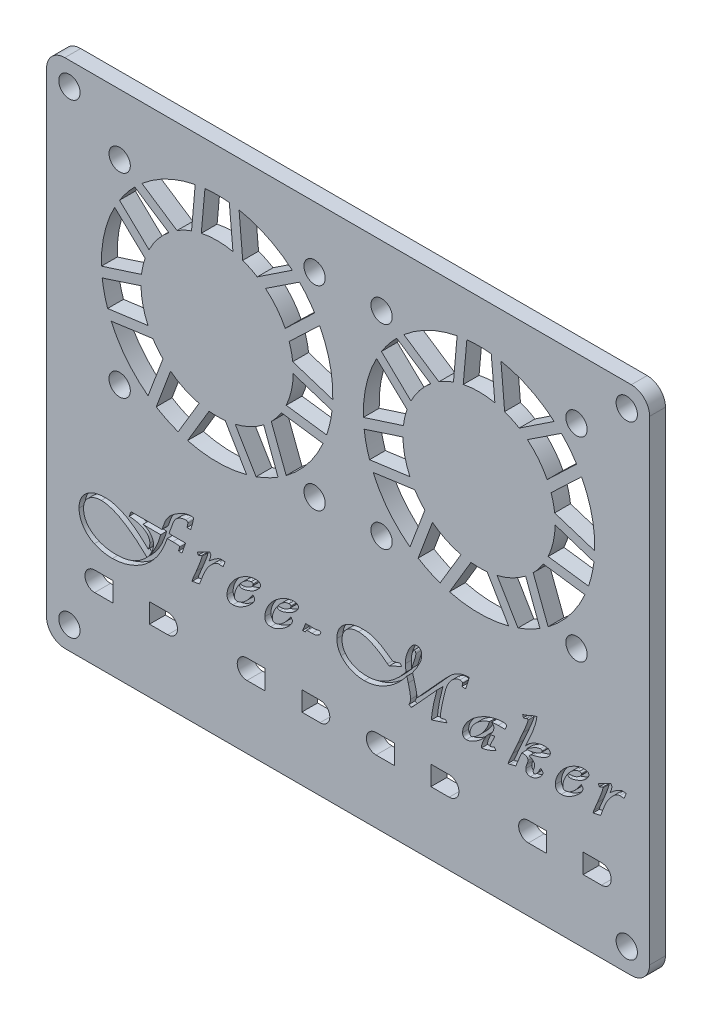
from build123d import *

# Parameters (mm, degrees)
SKETCH_1_R          = 1.75
EXTRUDE_1_DEPTH     = 2.6
SKETCH_3_R          = 1.75
CUT_EXTRUDE_2_DEPTH = 65.969300443
CUT_EXTRUDE_3_DEPTH = 65.969300443
CUT_EXTRUDE_4_DEPTH = 65.969300443
CUT_EXTRUDE_5_DEPTH = 1


with BuildPart() as part:
    # 草圖1 → 填料-伸長1 (new body)
    with BuildSketch(Plane.XY):
        with BuildLine():
            Line((-46.5, 42), (46.5, 42))
            ThreePointArc((46.5, 42), (48.621320344, 41.121320344), (49.5, 39))
            Line((49.5, 39), (49.5, -39))
            ThreePointArc((49.5, -39), (48.621320344, -41.121320344), (46.5, -42))
            Line((46.5, -42), (-46.5, -42))
            ThreePointArc((-46.5, -42), (-48.621320344, -41.121320344), (-49.5, -39))
            Line((-49.5, -39), (-49.5, 39))
            ThreePointArc((-49.5, 39), (-48.621320344, 41.121320344), (-46.5, 42))
        make_face()
        with Locations((-45.75, 38.25)):
            Circle(SKETCH_1_R, mode=Mode.SUBTRACT)
        with Locations(Location((45.75, 38.25, 0), (0, 0, 180))):
            Circle(SKETCH_1_R, mode=Mode.SUBTRACT)
        with Locations((45.75, -38.25)):
            Circle(SKETCH_1_R, mode=Mode.SUBTRACT)
        with Locations(Location((-45.75, -38.25, 0), (0, 0, 180))):
            Circle(SKETCH_1_R, mode=Mode.SUBTRACT)
    extrude(amount=EXTRUDE_1_DEPTH)

    # 草圖3 → 除料-伸長2 (cut, through all)
    with BuildSketch(Plane.XY.offset(2.6)):
        with Locations((-37.5, 32)):
            Circle(SKETCH_3_R)
        with Locations((-5.5, 32)):
            Circle(SKETCH_3_R)
        with Locations((-5.5, 0)):
            Circle(SKETCH_3_R)
        with Locations((-37.5, 0)):
            Circle(SKETCH_3_R)
        with Locations(Location((5.5, 0, 0), (0, 0, 180))):
            Circle(SKETCH_3_R)
        with Locations(Location((37.5, 0, 0), (0, 0, 180))):
            Circle(SKETCH_3_R)
        with Locations(Location((5.5, 32, 0), (0, 0, 180))):
            Circle(SKETCH_3_R)
        with Locations(Location((37.5, 32, 0), (0, 0, 180))):
            Circle(SKETCH_3_R)
    extrude(amount=-CUT_EXTRUDE_2_DEPTH, mode=Mode.SUBTRACT)

    # 草圖4 → 除料-伸長3 (cut, through all)
    with BuildSketch(Plane.XY.offset(2.6)):
        with BuildLine():
            Line((-25.1, 34.655830188), (-25.7, 27.773274821))
            ThreePointArc((-25.7, 27.773274821), (-26.923546739, 27.262110849), (-28.086059739, 26.624209011))
            Line((-28.086059739, 26.624209011), (-33.841152086, 30.446313204))
            ThreePointArc((-33.841152086, 30.446313204), (-29.743791043, 33.11840849), (-25.1, 34.655830188))
        make_face()
        with BuildLine():
            Line((-23.5, 34.894443628), (-24.1, 28.226610323))
            ThreePointArc((-24.1, 28.226610323), (-21.5, 28.5), (-18.9, 28.226610323))
            Line((-18.9, 28.226610323), (-19.5, 34.894443628))
            ThreePointArc((-19.5, 34.894443628), (-21.5, 35), (-23.5, 34.894443628))
        make_face()
        with BuildLine():
            Line((-17.9, 34.655830188), (-17.3, 27.773274821))
            ThreePointArc((-17.3, 27.773274821), (-16.076453261, 27.262110849), (-14.913940261, 26.624209011))
            Line((-14.913940261, 26.624209011), (-9.158847914, 30.446313204))
            ThreePointArc((-9.158847914, 30.446313204), (-13.256208957, 33.11840849), (-17.9, 34.655830188))
        make_face()
        with BuildLine():
            Line((-4.669721341, 24.81712653), (-9.676625926, 20.056824559))
            ThreePointArc((-9.676625926, 20.056824559), (-9.313401098, 18.781511674), (-9.087317837, 17.474897122))
            Line((-9.087317837, 17.474897122), (-2.510835063, 15.358427727))
            ThreePointArc((-2.510835063, 15.358427727), (-2.976369669, 20.227897745), (-4.669721341, 24.81712653))
        make_face()
        with BuildLine():
            Line((-5.480749524, 26.216829949), (-10.31977764, 21.590404994))
            ThreePointArc((-10.31977764, 21.590404994), (-11.727106469, 23.793622523), (-13.56192461, 25.655928702))
            Line((-13.56192461, 25.655928702), (-7.974708732, 29.344155879))
            ThreePointArc((-7.974708732, 29.344155879), (-6.645201833, 27.846306235), (-5.480749524, 26.216829949))
        make_face()
        with BuildLine():
            Line((-4.112985787, 8.338946759), (-10.956493682, 9.28550266))
            ThreePointArc((-10.956493682, 9.28550266), (-11.727106469, 8.206377477), (-12.607698254, 7.214957618))
            Line((-12.607698254, 7.214957618), (-10.162050717, 0.753659257))
            ThreePointArc((-10.162050717, 0.753659257), (-6.645201833, 4.153693765), (-4.112985787, 8.338946759))
        make_face()
        with BuildLine():
            Line((-3.52432139, 9.845734933), (-10.158490753, 10.74451068))
            ThreePointArc((-10.158490753, 10.74451068), (-9.313401098, 13.218488326), (-9.001381896, 15.814135823))
            Line((-9.001381896, 15.814135823), (-2.634237654, 13.745446582))
            ThreePointArc((-2.634237654, 13.745446582), (-2.976369669, 11.772102255), (-3.52432139, 9.845734933))
        make_face()
        with BuildLine():
            Line((-16.649026566, -2.370303665), (-20.175836744, 3.570334209))
            ThreePointArc((-20.175836744, 3.570334209), (-21.5, 3.5), (-22.824163256, 3.570334209))
            Line((-22.824163256, 3.570334209), (-26.350973434, -2.370303665))
            ThreePointArc((-26.350973434, -2.370303665), (-21.5, -3), (-16.649026566, -2.370303665))
        make_face()
        with BuildLine():
            Line((-15.103945886, -1.891072963), (-18.537591653, 3.856107017))
            ThreePointArc((-18.537591653, 3.856107017), (-16.076453261, 4.737889151), (-13.85255354, 6.11230246))
            Line((-13.85255354, 6.11230246), (-11.500070414, -0.155538007))
            ThreePointArc((-11.500070414, -0.155538007), (-13.256208957, -1.11840849), (-15.103945886, -1.891072963))
        make_face()
        with BuildLine():
            Line((-32.837949283, 0.753659257), (-30.392301746, 7.214957618))
            ThreePointArc((-30.392301746, 7.214957618), (-31.272893531, 8.206377477), (-32.043506318, 9.28550266))
            Line((-32.043506318, 9.28550266), (-38.887014213, 8.338946759))
            ThreePointArc((-38.887014213, 8.338946759), (-36.354798167, 4.153693765), (-32.837949283, 0.753659257))
        make_face()
        with BuildLine():
            Line((-31.499929586, -0.155538007), (-29.14744646, 6.11230246))
            ThreePointArc((-29.14744646, 6.11230246), (-26.923546739, 4.737889151), (-24.462408347, 3.856107017))
            Line((-24.462408347, 3.856107017), (-27.896054114, -1.891072963))
            ThreePointArc((-27.896054114, -1.891072963), (-29.743791043, -1.11840849), (-31.499929586, -0.155538007))
        make_face()
        with BuildLine():
            Line((-40.489164937, 15.358427727), (-33.912682163, 17.474897122))
            ThreePointArc((-33.912682163, 17.474897122), (-33.686598902, 18.781511674), (-33.323374074, 20.056824559))
            Line((-33.323374074, 20.056824559), (-38.330278659, 24.81712653))
            ThreePointArc((-38.330278659, 24.81712653), (-40.023630331, 20.227897745), (-40.489164937, 15.358427727))
        make_face()
        with BuildLine():
            Line((-40.365762346, 13.745446582), (-33.998618104, 15.814135823))
            ThreePointArc((-33.998618104, 15.814135823), (-33.686598902, 13.218488326), (-32.841509247, 10.74451068))
            Line((-32.841509247, 10.74451068), (-39.47567861, 9.845734933))
            ThreePointArc((-39.47567861, 9.845734933), (-40.023630331, 11.772102255), (-40.365762346, 13.745446582))
        make_face()
        with BuildLine():
            Line((-35.025291268, 29.344155879), (-29.43807539, 25.655928702))
            ThreePointArc((-29.43807539, 25.655928702), (-31.272893531, 23.793622523), (-32.68022236, 21.590404994))
            Line((-32.68022236, 21.590404994), (-37.519250476, 26.216829949))
            ThreePointArc((-37.519250476, 26.216829949), (-36.354798167, 27.846306235), (-35.025291268, 29.344155879))
        make_face()
        with BuildLine():
            Line((38.330278659, 24.81712653), (33.323374074, 20.056824559))
            ThreePointArc((33.323374074, 20.056824559), (33.686598902, 18.781511674), (33.912682163, 17.474897122))
            Line((33.912682163, 17.474897122), (40.489164937, 15.358427727))
            ThreePointArc((40.489164937, 15.358427727), (40.023630331, 20.227897745), (38.330278659, 24.81712653))
        make_face()
        with BuildLine():
            Line((37.519250476, 26.216829949), (32.68022236, 21.590404994))
            ThreePointArc((32.68022236, 21.590404994), (31.272893531, 23.793622523), (29.43807539, 25.655928702))
            Line((29.43807539, 25.655928702), (35.025291268, 29.344155879))
            ThreePointArc((35.025291268, 29.344155879), (36.354798167, 27.846306235), (37.519250476, 26.216829949))
        make_face()
        with BuildLine():
            Line((33.841152086, 30.446313204), (28.086059739, 26.624209011))
            ThreePointArc((28.086059739, 26.624209011), (26.923546739, 27.262110849), (25.7, 27.773274821))
            Line((25.7, 27.773274821), (25.1, 34.655830188))
            ThreePointArc((25.1, 34.655830188), (29.743791043, 33.11840849), (33.841152086, 30.446313204))
        make_face()
        with BuildLine():
            Line((38.887014213, 8.338946759), (32.043506318, 9.28550266))
            ThreePointArc((32.043506318, 9.28550266), (31.272893531, 8.206377477), (30.392301746, 7.214957618))
            Line((30.392301746, 7.214957618), (32.837949283, 0.753659257))
            ThreePointArc((32.837949283, 0.753659257), (36.354798167, 4.153693765), (38.887014213, 8.338946759))
        make_face()
        with BuildLine():
            Line((39.47567861, 9.845734933), (32.841509247, 10.74451068))
            ThreePointArc((32.841509247, 10.74451068), (33.686598902, 13.218488326), (33.998618104, 15.814135823))
            Line((33.998618104, 15.814135823), (40.365762346, 13.745446582))
            ThreePointArc((40.365762346, 13.745446582), (40.023630331, 11.772102255), (39.47567861, 9.845734933))
        make_face()
        with BuildLine():
            Line((26.350973434, -2.370303665), (22.824163256, 3.570334209))
            ThreePointArc((22.824163256, 3.570334209), (21.5, 3.5), (20.175836744, 3.570334209))
            Line((20.175836744, 3.570334209), (16.649026566, -2.370303665))
            ThreePointArc((16.649026566, -2.370303665), (21.5, -3), (26.350973434, -2.370303665))
        make_face()
        with BuildLine():
            Line((27.896054114, -1.891072963), (24.462408347, 3.856107017))
            ThreePointArc((24.462408347, 3.856107017), (26.923546739, 4.737889151), (29.14744646, 6.11230246))
            Line((29.14744646, 6.11230246), (31.499929586, -0.155538007))
            ThreePointArc((31.499929586, -0.155538007), (29.743791043, -1.11840849), (27.896054114, -1.891072963))
        make_face()
        with BuildLine():
            Line((10.162050717, 0.753659257), (12.607698254, 7.214957618))
            ThreePointArc((12.607698254, 7.214957618), (11.727106469, 8.206377477), (10.956493682, 9.28550266))
            Line((10.956493682, 9.28550266), (4.112985787, 8.338946759))
            ThreePointArc((4.112985787, 8.338946759), (6.645201833, 4.153693765), (10.162050717, 0.753659257))
        make_face()
        with BuildLine():
            Line((11.500070414, -0.155538007), (13.85255354, 6.11230246))
            ThreePointArc((13.85255354, 6.11230246), (16.076453261, 4.737889151), (18.537591653, 3.856107017))
            Line((18.537591653, 3.856107017), (15.103945886, -1.891072963))
            ThreePointArc((15.103945886, -1.891072963), (13.256208957, -1.11840849), (11.500070414, -0.155538007))
        make_face()
        with BuildLine():
            Line((2.510835063, 15.358427727), (9.087317837, 17.474897122))
            ThreePointArc((9.087317837, 17.474897122), (9.313401098, 18.781511674), (9.676625926, 20.056824559))
            Line((9.676625926, 20.056824559), (4.669721341, 24.81712653))
            ThreePointArc((4.669721341, 24.81712653), (2.976369669, 20.227897745), (2.510835063, 15.358427727))
        make_face()
        with BuildLine():
            Line((2.634237654, 13.745446582), (9.001381896, 15.814135823))
            ThreePointArc((9.001381896, 15.814135823), (9.313401098, 13.218488326), (10.158490753, 10.74451068))
            Line((10.158490753, 10.74451068), (3.52432139, 9.845734933))
            ThreePointArc((3.52432139, 9.845734933), (2.976369669, 11.772102255), (2.634237654, 13.745446582))
        make_face()
        with BuildLine():
            Line((9.158847914, 30.446313204), (14.913940261, 26.624209011))
            ThreePointArc((14.913940261, 26.624209011), (16.076453261, 27.262110849), (17.3, 27.773274821))
            Line((17.3, 27.773274821), (17.9, 34.655830188))
            ThreePointArc((17.9, 34.655830188), (13.256208957, 33.11840849), (9.158847914, 30.446313204))
        make_face()
        with BuildLine():
            Line((7.974708732, 29.344155879), (13.56192461, 25.655928702))
            ThreePointArc((13.56192461, 25.655928702), (11.727106469, 23.793622523), (10.31977764, 21.590404994))
            Line((10.31977764, 21.590404994), (5.480749524, 26.216829949))
            ThreePointArc((5.480749524, 26.216829949), (6.645201833, 27.846306235), (7.974708732, 29.344155879))
        make_face()
        with BuildLine():
            Line((19.5, 34.894443628), (18.9, 28.226610323))
            ThreePointArc((18.9, 28.226610323), (21.5, 28.5), (24.1, 28.226610323))
            Line((24.1, 28.226610323), (23.5, 34.894443628))
            ThreePointArc((23.5, 34.894443628), (21.5, 35), (19.5, 34.894443628))
        make_face()
    extrude(amount=-CUT_EXTRUDE_3_DEPTH, mode=Mode.SUBTRACT)

    # 草圖5 → 除料-伸長4 (cut, through all)
    with BuildSketch(Plane.XY.offset(2.6)):
        with BuildLine():
            Line((-41.6, -28.4), (-38.6, -28.4))
            Line((-38.6, -28.4), (-38.6, -31.6))
            Line((-38.6, -31.6), (-41.6, -31.6))
            ThreePointArc((-41.6, -31.6), (-43.2, -30), (-41.6, -28.4))
        make_face()
        with BuildLine():
            Line((-32.6, -31.6), (-29.6, -31.6))
            ThreePointArc((-29.6, -31.6), (-28, -30), (-29.6, -28.4))
            Line((-29.6, -28.4), (-32.6, -28.4))
            Line((-32.6, -28.4), (-32.6, -31.6))
        make_face()
        with BuildLine():
            Line((-16.6, -28.4), (-13.6, -28.4))
            Line((-13.6, -28.4), (-13.6, -31.6))
            Line((-13.6, -31.6), (-16.6, -31.6))
            ThreePointArc((-16.6, -31.6), (-18.2, -30), (-16.6, -28.4))
        make_face()
        with BuildLine():
            Line((-7.6, -31.6), (-4.6, -31.6))
            ThreePointArc((-4.6, -31.6), (-3, -30), (-4.6, -28.4))
            Line((-4.6, -28.4), (-7.6, -28.4))
            Line((-7.6, -28.4), (-7.6, -31.6))
        make_face()
        with BuildLine():
            ThreePointArc((4.6, -31.6), (3, -30), (4.6, -28.4))
            Line((4.6, -28.4), (7.6, -28.4))
            Line((7.6, -28.4), (7.6, -31.6))
            Line((7.6, -31.6), (4.6, -31.6))
        make_face()
        with BuildLine():
            ThreePointArc((16.6, -28.4), (18.2, -30), (16.6, -31.6))
            Line((16.6, -31.6), (13.6, -31.6))
            Line((13.6, -31.6), (13.6, -28.4))
            Line((13.6, -28.4), (16.6, -28.4))
        make_face()
        with BuildLine():
            ThreePointArc((29.6, -31.6), (28, -30), (29.6, -28.4))
            Line((29.6, -28.4), (32.6, -28.4))
            Line((32.6, -28.4), (32.6, -31.6))
            Line((32.6, -31.6), (29.6, -31.6))
        make_face()
        with BuildLine():
            ThreePointArc((41.6, -28.4), (43.2, -30), (41.6, -31.6))
            Line((41.6, -31.6), (38.6, -31.6))
            Line((38.6, -31.6), (38.6, -28.4))
            Line((38.6, -28.4), (41.6, -28.4))
        make_face()
    extrude(amount=-CUT_EXTRUDE_4_DEPTH, mode=Mode.SUBTRACT)

    # 草圖6 → 除料-伸長5 (cut)
    # profile 1 of 10: a face of its own
    with BuildSketch(Plane.XY.offset(2.6)):
        with BuildLine():
            Line((-26.689992674, -17.108153182), (-27.249879829, -18.820299568))
            Line((-27.249879829, -18.820299568), (-27.836519272, -18.820299568))
            add(Edge.make_bspline(
                [(-27.836519272, -18.820299568), (-27.820143986, -18.747424831), (-27.793373303, -18.639729222), (-27.768224763, -18.531271873), (-27.754351532, -18.497361243)],
                knots=[0, 0, 0, 0, 0.671438246, 1, 1, 1, 1], degree=3))
            add(Edge.make_bspline(
                [(-27.754351532, -18.497361243), (-27.724331066, -18.436720278), (-27.676536856, -18.330850221), (-27.650967762, -18.217037842), (-27.651164138, -18.168690285)],
                knots=[0, 0, 0, 0, 0.585176526, 1, 1, 1, 1], degree=3))
            add(Edge.make_bspline(
                [(-27.651164138, -18.168690285), (-27.647724555, -18.130647911), (-27.675357747, -18.075106829), (-27.74559476, -18.027912557), (-27.807372768, -18.00859975), (-27.873249937, -17.997322229), (-27.944567305, -17.987501337), (-28.03579615, -17.980521603), (-28.147974681, -17.975348993), (-28.279794389, -17.969200012), (-28.496379136, -17.964197932), (-28.668385118, -17.96363958), (-28.790047226, -17.964226375)],
                knots=[0, 0, 0, 0, 0.089513147, 0.140958047, 0.203539589, 0.246326876, 0.304505101, 0.379558967, 0.470056606, 0.579232207, 0.702371116, 1, 1, 1, 1], degree=3))
            Line((-28.790047226, -17.964226375), (-29.691981483, -17.964226375))
            Line((-29.691981483, -17.964226375), (-29.764594834, -18.159135897))
            add(Edge.make_bspline(
                [(-29.764594834, -18.159135897), (-29.861852352, -18.432054153), (-30.013716786, -18.831587208), (-30.231284125, -19.348750179), (-30.397642643, -19.71385313), (-30.56883979, -20.06352146), (-30.747374754, -20.396084084), (-30.92816404, -20.71327104), (-31.115135049, -21.0162804), (-31.310971418, -21.30857078), (-31.519577719, -21.59340989), (-31.741333302, -21.872690167), (-31.977372746, -22.146023311), (-32.225247053, -22.416267945), (-32.580188749, -22.769136647), (-32.8599699, -23.023835208), (-33.053215292, -23.188565907)],
                knots=[0, 0, 0, 0, 0.142763407, 0.21055886, 0.276433024, 0.340440603, 0.402364243, 0.462394464, 0.520317556, 0.577771046, 0.635714542, 0.694241641, 0.753443171, 0.813637271, 0.874891524, 1, 1, 1, 1], degree=3))
            add(Edge.make_bspline(
                [(-33.053215292, -23.188565907), (-33.241956299, -23.35047287), (-33.536421022, -23.582160188), (-33.950398775, -23.864073879), (-34.27370854, -24.062961083), (-34.609273132, -24.248806137), (-34.956646427, -24.421603916), (-35.314673413, -24.585452147), (-35.683550383, -24.733136576), (-36.057878104, -24.865889251), (-36.433415981, -24.984028838), (-36.809458849, -25.080428155), (-37.184851112, -25.161180604), (-37.559610306, -25.22494976), (-38.058199348, -25.282603161), (-38.43319096, -25.301688667), (-38.682660888, -25.301996602)],
                knots=[0, 0, 0, 0, 0.121614478, 0.183048123, 0.244865222, 0.307195893, 0.370584865, 0.434574946, 0.499711892, 0.564840642, 0.628787487, 0.692180286, 0.75462451, 0.816542001, 0.878019071, 1, 1, 1, 1], degree=3))
            add(Edge.make_bspline(
                [(-38.682660888, -25.301996602), (-38.949812237, -25.301084741), (-39.347295115, -25.285652695), (-39.866841048, -25.217177783), (-40.243640433, -25.151458524), (-40.608797536, -25.062961343), (-41.081894464, -24.923683533), (-41.423402879, -24.786560536), (-41.644521266, -24.682872239)],
                knots=[0, 0, 0, 0, 0.262866692, 0.390456997, 0.515186904, 0.638872526, 0.759782308, 1, 1, 1, 1], degree=3))
            add(Edge.make_bspline(
                [(-41.644521266, -24.682872239), (-41.837999258, -24.594125268), (-42.115356484, -24.441341565), (-42.461113965, -24.206708648), (-42.702869837, -24.019692839), (-42.927264248, -23.816658258), (-43.133396766, -23.597614977), (-43.326071072, -23.366534486), (-43.498059423, -23.119715131), (-43.656606404, -22.86497546), (-43.78877626, -22.598193226), (-43.90453599, -22.326875389), (-43.998911824, -22.047832112), (-44.071217971, -21.761506383), (-44.140048504, -21.366462404), (-44.163632724, -21.064493279), (-44.161147149, -20.861116913)],
                knots=[0, 0, 0, 0, 0.131797902, 0.195709148, 0.258691649, 0.320984438, 0.382945197, 0.444882081, 0.507171121, 0.569157001, 0.630563767, 0.691388465, 0.751779054, 0.812833676, 0.874135138, 1, 1, 1, 1], degree=3))
            add(Edge.make_bspline(
                [(-44.161147149, -20.861116913), (-44.160839322, -20.597837535), (-44.126531824, -20.209831579), (-44.002977726, -19.714996011), (-43.871344154, -19.37350833), (-43.706726119, -19.050141437), (-43.500861627, -18.750477792), (-43.259295293, -18.470454467), (-42.982980205, -18.213646406), (-42.675000518, -17.983812205), (-42.343971032, -17.779714048), (-41.987005677, -17.608949754), (-41.606853685, -17.469765984), (-41.202217067, -17.363543374), (-40.620115741, -17.255796309), (-40.166130451, -17.231343593), (-39.857850651, -17.230449353)],
                knots=[0, 0, 0, 0, 0.124637215, 0.183438538, 0.240896955, 0.297540125, 0.354832136, 0.41256053, 0.472301508, 0.533032751, 0.594213748, 0.656119453, 0.720037088, 0.785574464, 0.853946151, 1, 1, 1, 1], degree=3))
            add(Edge.make_bspline(
                [(-39.857850651, -17.230449353), (-39.478595253, -17.232961247), (-38.901631332, -17.287858264), (-38.142730713, -17.475101905), (-37.558830541, -17.668722618), (-36.969475602, -17.921478304), (-36.154786885, -18.341080987), (-35.562861853, -18.722472304), (-35.176200376, -19.005654702)],
                knots=[0, 0, 0, 0, 0.223586937, 0.339882906, 0.460163924, 0.585837772, 0.717493908, 1, 1, 1, 1], degree=3))
            add(Edge.make_bspline(
                [(-35.176200376, -19.005654702), (-35.018085975, -19.122847282), (-34.772207966, -19.307405066), (-34.441547639, -19.57580699), (-34.168248369, -19.803191353), (-33.879814996, -20.049869259), (-33.462682547, -20.414738302), (-33.145180891, -20.701313729), (-32.929008244, -20.899334466)],
                knots=[0, 0, 0, 0, 0.200840765, 0.313612049, 0.434524993, 0.563602765, 0.700864398, 1, 1, 1, 1], degree=3))
            Line((-32.929008244, -20.899334466), (-32.848751382, -21.065580823))
            add(Edge.make_bspline(
                [(-32.848751382, -21.065580823), (-32.749409594, -20.914757311), (-32.592824406, -20.584266948), (-32.542643976, -20.222019086), (-32.543010956, -20.041350395)],
                knots=[0, 0, 0, 0, 0.499901019, 1, 1, 1, 1], degree=3))
            add(Edge.make_bspline(
                [(-32.543010956, -20.041350395), (-32.542114201, -19.901576859), (-32.569003425, -19.69182107), (-32.665626075, -19.428851371), (-32.763403052, -19.239934411), (-32.891195486, -19.060917223), (-33.048187728, -18.892771799), (-33.230505904, -18.731168972), (-33.441358566, -18.581563206), (-33.67522423, -18.442119864), (-33.93346181, -18.319917649), (-34.212870303, -18.213455263), (-34.514822932, -18.121486927), (-34.838468118, -18.045743914), (-35.312938496, -17.965329817), (-35.6815992, -17.931112257), (-35.934818808, -17.920276189)],
                knots=[0, 0, 0, 0, 0.095361061, 0.142504449, 0.190504987, 0.240053701, 0.292019923, 0.347117657, 0.405959832, 0.468105205, 0.532626222, 0.600567609, 0.671899012, 0.747778979, 0.827138081, 1, 1, 1, 1], degree=3))
            add(Edge.make_bspline(
                [(-35.934818808, -17.920276189), (-35.755346679, -17.532080816), (-35.623345749, -17.125351081)],
                knots=[0, 0, 0, 1, 1, 1], degree=2))
            Line((-35.623345749, -17.125351081), (-30.540411165, -17.108153182))
            add(Edge.make_bspline(
                [(-30.540411165, -17.108153182), (-30.512347779, -17.026729169), (-30.483084835, -16.945728581)],
                knots=[0, 0, 0, 1, 1, 1], degree=2))
            add(Edge.make_bspline(
                [(-30.483084835, -16.945728581), (-30.433542512, -16.794284315), (-30.359277131, -16.576371246), (-30.262491323, -16.297084499), (-30.192417982, -16.114582874), (-30.130945558, -15.947202739), (-30.068503513, -15.799174659), (-30.014485908, -15.666133818), (-29.942186559, -15.513611297), (-29.851694702, -15.334352533), (-29.68083285, -15.064151881), (-29.535737739, -14.87201818), (-29.428280365, -14.752041023)],
                knots=[0, 0, 0, 0, 0.19485188, 0.281573499, 0.361439935, 0.433921978, 0.499596261, 0.557899567, 0.609476665, 0.7059843, 0.803252873, 1, 1, 1, 1], degree=3))
            add(Edge.make_bspline(
                [(-29.428280365, -14.752041023), (-29.212648799, -14.508219694), (-28.696242121, -14.031064137), (-28.107605777, -13.647136298), (-27.784925575, -13.456465968)],
                knots=[0, 0, 0, 0, 0.464398928, 1, 1, 1, 1], degree=3))
            add(Edge.make_bspline(
                [(-27.784925575, -13.456465968), (-27.615647191, -13.358907008), (-27.365981515, -13.221289783), (-27.027840241, -13.074731204), (-26.793445813, -12.983457922), (-26.567468899, -12.913772142), (-26.286937112, -12.85282848), (-26.079795481, -12.825784557), (-25.944750385, -12.827787216)],
                knots=[0, 0, 0, 0, 0.298372512, 0.434181738, 0.562175518, 0.682096919, 0.794594844, 1, 1, 1, 1], degree=3))
            add(Edge.make_bspline(
                [(-25.944750385, -12.827787216), (-25.870862418, -12.828162742), (-25.667575484, -12.826806492), (-25.464557588, -12.815612149), (-25.33518041, -12.814411073)],
                knots=[0, 0, 0, 0, 0.363548698, 1, 1, 1, 1], degree=3))
            add(Edge.make_bspline(
                [(-25.33518041, -12.814411073), (-25.353528644, -12.93281532), (-25.387088687, -13.116302076), (-25.445148623, -13.367489769), (-25.493629136, -13.576419746), (-25.553964606, -13.796875273), (-25.643412532, -14.117926109), (-25.714367398, -14.364777709), (-25.76894964, -14.532290092)],
                knots=[0, 0, 0, 0, 0.20271369, 0.315387744, 0.436140539, 0.565527853, 0.702003898, 1, 1, 1, 1], degree=3))
            Line((-25.76894964, -14.532290092), (-25.843473869, -14.784525944))
            Line((-25.843473869, -14.784525944), (-26.4396677, -14.784525944))
            add(Edge.make_bspline(
                [(-26.4396677, -14.784525944), (-26.402567145, -14.636153709), (-26.349157009, -14.406709269), (-26.30779539, -14.174088589), (-26.305906263, -14.090877352)],
                knots=[0, 0, 0, 0, 0.64817155, 1, 1, 1, 1], degree=3))
            add(Edge.make_bspline(
                [(-26.305906263, -14.090877352), (-26.305349482, -14.048545685), (-26.315492303, -13.986515717), (-26.355204823, -13.914857067), (-26.398841507, -13.874740063), (-26.452926561, -13.843064163), (-26.545811083, -13.811416481), (-26.624089773, -13.805439935), (-26.678527408, -13.80615658)],
                knots=[0, 0, 0, 0, 0.237330098, 0.344537579, 0.453163523, 0.565257122, 0.694032956, 1, 1, 1, 1], degree=3))
            add(Edge.make_bspline(
                [(-26.678527408, -13.80615658), (-26.790141539, -13.805360663), (-26.958454786, -13.823477565), (-27.181033745, -13.870914773), (-27.350688553, -13.922803595), (-27.520265567, -13.992893642), (-27.75398742, -14.104271814), (-27.924194512, -14.205764822), (-28.033339671, -14.283875996)],
                knots=[0, 0, 0, 0, 0.229153017, 0.347096395, 0.467687607, 0.593461889, 0.724135162, 1, 1, 1, 1], degree=3))
            add(Edge.make_bspline(
                [(-28.033339671, -14.283875996), (-28.133527456, -14.35497381), (-28.274901241, -14.481803261), (-28.430502977, -14.685704911), (-28.524221302, -14.830345532), (-28.592663379, -14.966985074), (-28.655447446, -15.091122107), (-28.718753195, -15.239793984), (-28.787658408, -15.411607028), (-28.864027388, -15.604801806), (-28.976368446, -15.909000701), (-29.060082006, -16.149319566), (-29.118718184, -16.317049829)],
                knots=[0, 0, 0, 0, 0.157421752, 0.241154386, 0.328082322, 0.377716569, 0.436834449, 0.506264879, 0.584603399, 0.674004643, 0.772373632, 1, 1, 1, 1], degree=3))
            Line((-29.118718184, -16.317049829), (-29.387430249, -17.108153182))
            Line((-29.387430249, -17.108153182), (-26.689992674, -17.108153182))
        make_face()
        with BuildLine():
            Line((-30.775449118, -17.964226375), (-33.683804921, -17.947028476))
            add(Edge.make_bspline(
                [(-33.683804921, -17.947028476), (-33.564577029, -17.965020501), (-33.389566329, -18.010511225), (-33.168236911, -18.103426682), (-33.00936, -18.187427455), (-32.857003508, -18.287789739), (-32.712098933, -18.404553971), (-32.573472046, -18.537621979), (-32.444096276, -18.684766553), (-32.325501111, -18.839766597), (-32.218785128, -18.996266187), (-32.131521697, -19.155611706), (-32.057267723, -19.314523218), (-32.002036769, -19.476175614), (-31.948794708, -19.69125488), (-31.930310406, -19.855767661), (-31.931530104, -19.964915289)],
                knots=[0, 0, 0, 0, 0.125442448, 0.18726378, 0.249556293, 0.312270895, 0.376891604, 0.443018919, 0.512073624, 0.580642698, 0.646115139, 0.709039723, 0.76957091, 0.828497263, 0.886555375, 1, 1, 1, 1], degree=3))
            add(Edge.make_bspline(
                [(-31.931530104, -19.964915289), (-31.932079489, -20.142149143), (-31.970361168, -20.414335559), (-32.078360659, -20.776135369), (-32.196824413, -21.064917737), (-32.346481939, -21.36492151), (-32.514507034, -21.650727009), (-32.63683369, -21.833149734), (-32.69422082, -21.915030677)],
                knots=[0, 0, 0, 0, 0.202262236, 0.312421283, 0.431039733, 0.558728175, 0.695515445, 0.809827559, 0.809827559, 0.809827559, 0.809827559], degree=3))
            add(Edge.make_bspline(
                [(-32.69422082, -21.915030677), (-32.665165553, -21.879267664), (-32.499507934, -21.671737555), (-32.212160677, -21.273245844), (-31.85526474, -20.696944246), (-31.534575812, -20.075219183), (-31.143700568, -19.171804513), (-30.90669832, -18.457400219), (-30.775449118, -17.964226375)],
                knots=[0.580480459, 0.580480459, 0.580480459, 0.580480459, 0.593586346, 0.656005311, 0.720124617, 0.786261536, 0.854838542, 1, 1, 1, 1], degree=3))
        make_face(mode=Mode.SUBTRACT)
        with BuildLine():
            add(Edge.make_bspline(
                [(-33.018458019, -22.289442939), (-33.18776943, -22.123824336), (-33.533095904, -21.795115166), (-34.057452846, -21.320070817), (-34.58025323, -20.866586933), (-35.095167347, -20.445437798), (-35.600919946, -20.054909961), (-36.09948214, -19.697549056), (-36.589596162, -19.371839113), (-37.06945624, -19.077233622), (-37.540443972, -18.817367346), (-37.998643788, -18.587542356), (-38.447931803, -18.39732712), (-38.884112965, -18.238133614), (-39.309895045, -18.118305407), (-39.85022767, -18.000323397), (-40.255966738, -17.964970084), (-40.5209252, -17.964226375)],
                knots=[0.004157376, 0.004157376, 0.004157376, 0.004157376, 0.084117725, 0.165115312, 0.243026316, 0.317760753, 0.38968212, 0.458732438, 0.524820985, 0.588334399, 0.648785462, 0.706395964, 0.761320255, 0.813428453, 0.863056759, 0.910551191, 1, 1, 1, 1], degree=3))
            add(Edge.make_bspline(
                [(-40.5209252, -17.964226375), (-40.719613448, -17.9652201), (-41.013636018, -17.984131327), (-41.39281987, -18.058735236), (-41.659222212, -18.137638546), (-41.913551468, -18.237086526), (-42.15441061, -18.359931358), (-42.383447531, -18.503567905), (-42.596046185, -18.669343418), (-42.790551329, -18.851690656), (-42.962631253, -19.049052505), (-43.105909648, -19.262040221), (-43.224064191, -19.488220342), (-43.315654346, -19.727375733), (-43.404833161, -20.070823898), (-43.425984757, -20.340567748), (-43.427370126, -20.522891566)],
                knots=[0, 0, 0, 0, 0.137504638, 0.203094015, 0.266950992, 0.329465144, 0.39173657, 0.453717349, 0.516208202, 0.577928432, 0.637909713, 0.696938229, 0.755078548, 0.814079099, 0.873714645, 1, 1, 1, 1], degree=3))
            add(Edge.make_bspline(
                [(-43.427370126, -20.522891566), (-43.429895031, -20.801914995), (-43.382066712, -21.215237487), (-43.221645217, -21.739109296), (-43.054148969, -22.106584443), (-42.838169611, -22.45328696), (-42.573034144, -22.777284021), (-42.263511874, -23.083642517), (-41.906364337, -23.362923016), (-41.514816261, -23.618231915), (-41.092831122, -23.839788184), (-40.645434755, -24.028116826), (-40.171809858, -24.179686496), (-39.673434611, -24.301548597), (-38.958791557, -24.4130241), (-38.406613448, -24.447034437), (-38.031051605, -24.445923409)],
                knots=[0, 0, 0, 0, 0.11241776, 0.166441878, 0.220346814, 0.274796006, 0.330671816, 0.388788262, 0.450038622, 0.513155468, 0.57703276, 0.641953314, 0.708636221, 0.777345922, 0.84862052, 1, 1, 1, 1], degree=3))
            add(Edge.make_bspline(
                [(-38.031051605, -24.445923409), (-37.810907377, -24.448624371), (-37.484270051, -24.431572984), (-37.053525579, -24.390004346), (-36.74023718, -24.340689232), (-36.432585207, -24.282678099), (-36.131757639, -24.20933738), (-35.836681647, -24.124047509), (-35.549085172, -24.02201723), (-35.266962699, -23.909324179), (-34.991838049, -23.783532927), (-34.723365764, -23.642701964), (-34.459909114, -23.490907357), (-34.204290645, -23.323976649), (-33.954104534, -23.145977404), (-33.711901769, -22.952405394), (-33.395237328, -22.676686209), (-33.167589042, -22.450668893), (-33.021124102, -22.292329661), (-33.018458019, -22.289442939)],
                knots=[0, 0, 0, 0, 0.062587578, 0.093006718, 0.123069139, 0.152780507, 0.182052605, 0.211126589, 0.240126499, 0.268830483, 0.297535611, 0.326147351, 0.355053121, 0.384004864, 0.412970216, 0.442374951, 0.472173505, 0.532398759, 0.533516316, 0.533516316, 0.533516316, 0.533516316], degree=3))
        make_face(mode=Mode.SUBTRACT)
    # profile 2 of 10: a face of its own
    with BuildSketch(Plane.XY.offset(2.6)):
        with BuildLine():
            Line((-20.206002587, -16.548266027), (-20.527030034, -17.400517465))
            add(Edge.make_bspline(
                [(-20.527030034, -17.400517465), (-20.660781501, -17.38888266), (-20.88052235, -17.363002668), (-21.101541383, -17.355486794), (-21.188193706, -17.352745523)],
                knots=[0, 0, 0, 0, 0.607672298, 1, 1, 1, 1], degree=3))
            add(Edge.make_bspline(
                [(-21.188193706, -17.352745523), (-21.308792711, -17.354036024), (-21.497152626, -17.391522509), (-21.737270468, -17.505850968), (-21.933389723, -17.625366467), (-22.135208217, -17.780245196), (-22.431288196, -18.041296564), (-22.638351746, -18.273117735), (-22.778043921, -18.438124036)],
                knots=[0, 0, 0, 0, 0.182509792, 0.28665914, 0.401941358, 0.530199638, 0.671842756, 1, 1, 1, 1], degree=3))
            add(Edge.make_bspline(
                [(-22.778043921, -18.438124036), (-22.913916476, -18.602230873), (-23.104709602, -18.865706912), (-23.332896444, -19.242664746), (-23.470006168, -19.498170484), (-23.578741791, -19.720378691), (-23.664569854, -19.910623418), (-23.755809643, -20.122325561), (-23.853508233, -20.356007305), (-23.956576634, -20.611251463), (-24.103848004, -20.995323014), (-24.216315935, -21.294165828), (-24.291459031, -21.50126093)],
                knots=[0, 0, 0, 0, 0.186065055, 0.283692143, 0.384770836, 0.439272052, 0.499784944, 0.567079032, 0.640659372, 0.721051033, 0.807545121, 1, 1, 1, 1], degree=3))
            Line((-24.291459031, -21.50126093), (-24.387002914, -21.76305117))
            add(Edge.make_bspline(
                [(-24.387002914, -21.76305117), (-24.999438718, -21.883546473), (-25.609964618, -22.013376144)],
                knots=[0, 0, 0, 1, 1, 1], degree=2))
            Line((-25.609964618, -22.013376144), (-25.523975124, -21.654131143))
            Line((-25.523975124, -21.654131143), (-24.893385495, -20.163646566))
            add(Edge.make_bspline(
                [(-24.893385495, -20.163646566), (-24.823931301, -19.994860225), (-24.72257122, -19.749296634), (-24.592405337, -19.430509627), (-24.50773804, -19.211253511), (-24.427075091, -19.007202361), (-24.353376577, -18.817141134), (-24.289882769, -18.639919452), (-24.229282645, -18.477570033), (-24.178877611, -18.328511501), (-24.131565114, -18.194172293), (-24.093759742, -18.072954655), (-24.063677602, -17.965614166), (-24.037444659, -17.873104219), (-24.016694052, -17.777083006), (-24.008140513, -17.711012602), (-24.006738259, -17.671862093)],
                knots=[0, 0, 0, 0, 0.206587733, 0.300706739, 0.389739937, 0.472613835, 0.549067231, 0.6204578, 0.685688633, 0.745198125, 0.798549887, 0.846892509, 0.888882422, 0.92473572, 0.955703868, 1, 1, 1, 1], degree=3))
            add(Edge.make_bspline(
                [(-24.006738259, -17.671862093), (-24.005034811, -17.599073488), (-24.077440732, -17.597337864)],
                knots=[0, 0, 0, 1, 1, 1], degree=2))
            add(Edge.make_bspline(
                [(-24.077440732, -17.597337864), (-24.090774499, -17.601294253), (-24.119333696, -17.608522954), (-24.166045162, -17.625846254), (-24.224846477, -17.646929776), (-24.297500832, -17.675921194), (-24.426694495, -17.721876699), (-24.528562653, -17.764856419), (-24.60293209, -17.792247386)],
                knots=[0, 0, 0, 0, 0.074440355, 0.157440068, 0.266348653, 0.408768779, 0.575918935, 1, 1, 1, 1], degree=3))
            Line((-24.60293209, -17.792247386), (-24.773000202, -17.413893608))
            add(Edge.make_bspline(
                [(-24.773000202, -17.413893608), (-23.731770752, -16.948212666), (-22.734093735, -16.395395814)],
                knots=[0, 0, 0, 1, 1, 1], degree=2))
            add(Edge.make_bspline(
                [(-22.734093735, -16.395395814), (-22.682563897, -16.459915584), (-22.599319485, -16.559196935), (-22.5416217, -16.677848243), (-22.539184214, -16.725977649)],
                knots=[0, 0, 0, 0, 0.636405709, 1, 1, 1, 1], degree=3))
            add(Edge.make_bspline(
                [(-22.539184214, -16.725977649), (-22.538970266, -16.819345466), (-22.559762034, -16.967615344), (-22.61383546, -17.172886819), (-22.674197005, -17.352209797), (-22.745439858, -17.54094559), (-22.800046678, -17.668419954), (-22.827977193, -17.730962522)],
                knots=[0, 0, 0, 0, 0.173399632, 0.277530221, 0.394918802, 0.525538809, 0.65306188, 0.65306188, 0.65306188, 0.65306188], degree=3))
            add(Edge.make_bspline(
                [(-22.827977193, -17.730962522), (-22.766665006, -17.676871945), (-22.642210952, -17.569961778), (-22.457565153, -17.414224308), (-22.275258242, -17.268416122), (-22.100558474, -17.13541458), (-21.933528232, -17.014499769), (-21.77549838, -16.905229534), (-21.624596864, -16.80928575), (-21.480724686, -16.727174305), (-21.345545494, -16.655795272), (-21.217416297, -16.597887991), (-21.096465732, -16.553965126), (-20.953167913, -16.511431502), (-20.846987609, -16.495862113), (-20.779265886, -16.49667233)],
                knots=[0.193935876, 0.193935876, 0.193935876, 0.193935876, 0.275357703, 0.357301497, 0.434468819, 0.507794504, 0.575926822, 0.639791987, 0.699093867, 0.7539297, 0.804712531, 0.851275642, 0.893815656, 0.932761272, 1, 1, 1, 1], degree=3))
            add(Edge.make_bspline(
                [(-20.779265886, -16.49667233), (-20.703975769, -16.498377281), (-20.512282297, -16.51033421), (-20.322090032, -16.537156434), (-20.206002587, -16.548266027)],
                knots=[0, 0, 0, 0, 0.392356996, 1, 1, 1, 1], degree=3))
        make_face()
    # profile 3 of 10: a face of its own
    with BuildSketch(Plane.XY.offset(2.6)):
        with BuildLine():
            Line((-6.966295609, -18.698003398), (-5.913402017, -18.698003398))
            Line((-5.913402017, -18.698003398), (-5.626770367, -18.698003398))
            add(Edge.make_bspline(
                [(-5.626770367, -18.698003398), (-5.461120055, -18.694661879), (-5.159282524, -18.685208522), (-4.867122682, -18.608553486), (-4.742034009, -18.560420206)],
                knots=[0, 0, 0, 0, 0.553514523, 1, 1, 1, 1], degree=3))
            add(Edge.make_bspline(
                [(-4.742034009, -18.560420206), (-4.724403067, -18.557643919), (-4.665476217, -18.586317205), (-4.603812094, -18.597777353), (-4.562411509, -18.621568291)],
                knots=[0, 0, 0, 0, 0.270266742, 1, 1, 1, 1], degree=3))
            Line((-4.562411509, -18.621568291), (-4.45540236, -18.743864462))
            Line((-4.45540236, -18.743864462), (-4.495530791, -18.827943079))
            add(Edge.make_bspline(
                [(-4.495530791, -18.827943079), (-4.544410485, -18.946471836), (-4.654437421, -19.104945245), (-4.844952415, -19.278136458), (-5.01676213, -19.377918053), (-5.209998403, -19.460402536), (-5.51738659, -19.534052525), (-5.76329062, -19.555129927), (-5.934421671, -19.554076591)],
                knots=[0, 0, 0, 0, 0.223101228, 0.333723444, 0.44832998, 0.569333757, 0.700566555, 1, 1, 1, 1], degree=3))
            Line((-5.934421671, -19.554076591), (-6.272647017, -19.554076591))
            Line((-6.272647017, -19.554076591), (-6.62998114, -19.554076591))
            add(Edge.make_bspline(
                [(-6.62998114, -19.554076591), (-6.672181588, -19.557650702), (-6.729492814, -19.553179792), (-6.792562947, -19.562017757), (-6.823372868, -19.569340364), (-6.845278972, -19.596404017), (-6.892605912, -19.662108504), (-6.922310027, -19.730833074), (-6.952919466, -19.777649278)],
                knots=[0, 0, 0, 0, 0.292037059, 0.384458442, 0.439567907, 0.501182163, 0.613617628, 1, 1, 1, 1], degree=3))
            Line((-6.952919466, -19.777649278), (-7.03126545, -19.920965102))
            Line((-7.03126545, -19.920965102), (-7.461212924, -19.920965102))
            Line((-7.461212924, -19.920965102), (-6.966295609, -18.698003398))
        make_face()
    # profile 4 of 10: a face of its own
    with BuildSketch(Plane.XY.offset(2.6)):
        with BuildLine():
            Line((19.904848267, -12.927152855), (19.287634782, -14.853317539))
            Line((19.287634782, -14.853317539), (18.706727972, -14.797902087))
            Line((18.706727972, -14.797902087), (18.762143424, -14.524646581))
            add(Edge.make_bspline(
                [(18.762143424, -14.524646581), (18.811857556, -14.407943732), (18.821380632, -14.281965118)],
                knots=[0, 0, 0, 1, 1, 1], degree=2))
            add(Edge.make_bspline(
                [(18.821380632, -14.281965118), (18.820179592, -14.2474152), (18.808335609, -14.190508306), (18.754491, -14.138255907), (18.702523915, -14.103794696), (18.63480002, -14.080668121), (18.517004088, -14.056686533), (18.42029521, -14.050263068), (18.351304727, -14.050748921)],
                knots=[0, 0, 0, 0, 0.182678639, 0.277965339, 0.380035298, 0.502713012, 0.643847279, 1, 1, 1, 1], degree=3))
            add(Edge.make_bspline(
                [(18.351304727, -14.050748921), (18.242698345, -14.04836787), (18.078992877, -14.073838643), (17.866630977, -14.142466778), (17.704081668, -14.213825466), (17.542044879, -14.308332216), (17.379813941, -14.423762524), (17.216598893, -14.558767368), (17.05316974, -14.712587054), (16.89371801, -14.885246863), (16.742165443, -15.075848881), (16.599204087, -15.282019706), (16.464460026, -15.505373969), (16.340144574, -15.745588377), (16.176803533, -16.092702512), (16.07731651, -16.368774777), (16.014301345, -16.557820415)],
                knots=[0, 0, 0, 0, 0.089406086, 0.135849765, 0.184164796, 0.235808839, 0.290574868, 0.348536176, 0.41072228, 0.475910258, 0.54257966, 0.611791794, 0.683107688, 0.757979219, 0.835220519, 1, 1, 1, 1], degree=3))
            add(Edge.make_bspline(
                [(16.014301345, -16.557820415), (15.975690028, -16.684243454), (15.912756885, -16.888005097), (15.837519086, -17.182914836), (15.772729702, -17.447943313), (15.703858289, -17.742855874), (15.631404276, -18.067752971), (15.555056885, -18.423206547), (15.477329849, -18.797739452), (15.402349597, -19.168258065), (15.338821429, -19.513366208), (15.279081108, -19.81962984), (15.236765833, -20.090960653), (15.198896644, -20.32433204), (15.169152157, -20.562465368), (15.154188185, -20.722544763), (15.152495519, -20.817166726)],
                knots=[0, 0, 0, 0, 0.091150623, 0.146962747, 0.209802594, 0.27925322, 0.355749157, 0.439296423, 0.529899632, 0.619466754, 0.699909529, 0.771827834, 0.834564792, 0.88921951, 0.934809663, 1, 1, 1, 1], degree=3))
            add(Edge.make_bspline(
                [(15.152495519, -20.817166726), (15.153601032, -20.869546567), (15.152254322, -20.945019333), (15.19109334, -21.019993324), (15.221287114, -21.021630636)],
                knots=[0, 0, 0, 0, 0.667210286, 1, 1, 1, 1], degree=3))
            add(Edge.make_bspline(
                [(15.221287114, -21.021630636), (15.318348501, -21.018111382), (15.574450359, -20.967399807), (15.825028451, -20.896827361), (15.981816424, -20.849651647)],
                knots=[0, 0, 0, 0, 0.371596299, 1, 1, 1, 1], degree=3))
            Line((15.981816424, -20.849651647), (16.228319643, -21.21462928))
            add(Edge.make_bspline(
                [(16.228319643, -21.21462928), (16.043481171, -21.285913017), (15.620526547, -21.438119705), (15.195817199, -21.58529849), (14.957585997, -21.665596409)],
                knots=[0, 0, 0, 0, 0.440705668, 1, 1, 1, 1], degree=3))
            add(Edge.make_bspline(
                [(14.957585997, -21.665596409), (14.332449842, -21.875907918), (13.698317617, -22.05732633)],
                knots=[0, 0, 0, 1, 1, 1], degree=2))
            add(Edge.make_bspline(
                [(13.698317617, -22.05732633), (13.700973388, -21.922196212), (13.709285091, -21.705595097), (13.743150651, -21.400430181), (13.773929379, -21.131198428), (13.820406283, -20.836138084), (13.869944033, -20.51390329), (13.935136111, -20.166044338), (14.027243892, -19.670714439), (14.157787805, -19.047522095), (14.329675547, -18.317004913), (14.473027632, -17.762761602), (14.559165094, -17.45267965), (14.581209481, -17.374770896)],
                knots=[0, 0, 0, 0, 0.077564352, 0.124214924, 0.176111985, 0.233010497, 0.295549291, 0.36313975, 0.436026652, 0.584591837, 0.728359052, 0.866533895, 0.912983715, 0.912983715, 0.912983715, 0.912983715], degree=3))
            add(Edge.make_bspline(
                [(14.581209481, -17.374770896), (14.578637241, -17.377617958), (14.540704882, -17.419673122), (14.465036046, -17.506017272), (14.348976754, -17.635793207), (14.219527622, -17.774689125), (14.031199336, -17.987394342), (13.878865411, -18.147526282), (13.778574479, -18.262323291)],
                knots=[0.177244405, 0.177244405, 0.177244405, 0.177244405, 0.185158658, 0.294045673, 0.414062601, 0.544241576, 0.685644571, 1, 1, 1, 1], degree=3))
            Line((13.778574479, -18.262323291), (12.21547655, -19.98020231))
            Line((12.21547655, -19.98020231), (10.625626334, -21.715279228))
            Line((10.625626334, -21.715279228), (10.365746972, -21.931208404))
            Line((10.365746972, -21.931208404), (9.985482317, -21.732477127))
            add(Edge.make_bspline(
                [(9.985482317, -21.732477127), (10.068393718, -21.580728964), (10.200391749, -21.292516744), (10.260685094, -20.980604011), (10.260648701, -20.838186381)],
                knots=[0, 0, 0, 0, 0.549763527, 1, 1, 1, 1], degree=3))
            add(Edge.make_bspline(
                [(10.260648701, -20.838186381), (10.259989686, -20.707953408), (10.246972385, -20.500115029), (10.207065123, -20.208939195), (10.16492147, -19.954705528), (10.110665281, -19.677056335), (10.021230136, -19.25833482), (9.936963523, -18.93493066), (9.878473168, -18.711379542)],
                knots=[0, 0, 0, 0, 0.180357507, 0.288043115, 0.406981373, 0.537275888, 0.679867784, 1, 1, 1, 1], degree=3))
            Line((9.878473168, -18.711379542), (9.649167848, -17.864860737))
            add(Edge.make_bspline(
                [(9.649167848, -17.864860737), (9.65047156, -17.858451552), (9.652511563, -17.852455013)],
                knots=[0, 0, 0, 0.177044587, 0.177044587, 0.177044587], degree=2))
            add(Edge.make_bspline(
                [(9.652511563, -17.852455013), (9.543744715, -17.997988888), (9.311709183, -18.298133076), (8.942932291, -18.73638819), (8.546503813, -19.161424153), (8.136687788, -19.559564429), (7.714491096, -19.932703627), (7.278936533, -20.279454263), (6.828093567, -20.596786894), (6.368038297, -20.888318204), (5.902609082, -21.149114282), (5.436384304, -21.376084833), (4.971282079, -21.568007099), (4.507108823, -21.724699978), (4.04449192, -21.848163354), (3.433812342, -21.965694966), (2.971096062, -21.999505255), (2.664909989, -22)],
                knots=[0.006893722, 0.006893722, 0.006893722, 0.006893722, 0.071241638, 0.14119316, 0.209661095, 0.276977508, 0.343459578, 0.409124988, 0.474025027, 0.538607554, 0.601925409, 0.662859554, 0.722132746, 0.779982757, 0.836229127, 0.891572681, 1, 1, 1, 1], degree=3))
            add(Edge.make_bspline(
                [(2.664909989, -22), (2.474773457, -21.999512686), (2.191010384, -21.985118356), (1.815952219, -21.939595892), (1.53985625, -21.889800926), (1.267101455, -21.825995022), (0.997946605, -21.750850356), (0.733401073, -21.657342739), (0.472983897, -21.554172375), (0.222205375, -21.435549738), (-0.016900711, -21.308296248), (-0.241243339, -21.17001277), (-0.452709655, -21.02233197), (-0.650941301, -20.864467733), (-0.895191323, -20.641147192), (-1.057556501, -20.455608667), (-1.158756215, -20.327982045)],
                knots=[0, 0, 0, 0, 0.132215761, 0.197382123, 0.262640268, 0.327221298, 0.392147814, 0.45687302, 0.522270848, 0.586874664, 0.649701338, 0.710559008, 0.770040337, 0.828984773, 0.886675734, 1, 1, 1, 1], degree=3))
            add(Edge.make_bspline(
                [(-1.158756215, -20.327982045), (-1.269942552, -20.182992598), (-1.422368628, -19.954555279), (-1.580632172, -19.62610155), (-1.679056976, -19.371437325), (-1.753097662, -19.106322693), (-1.825692937, -18.735773555), (-1.845800217, -18.449592421), (-1.846672174, -18.256590658)],
                knots=[0, 0, 0, 0, 0.246601616, 0.368799731, 0.491184974, 0.614396799, 0.739593739, 1, 1, 1, 1], degree=3))
            add(Edge.make_bspline(
                [(-1.846672174, -18.256590658), (-1.844899692, -18.008914158), (-1.814195156, -17.641560905), (-1.684597329, -17.175953596), (-1.556049565, -16.849524154), (-1.384839008, -16.54353435), (-1.179747622, -16.254690815), (-0.934827916, -15.986587759), (-0.655623313, -15.739032958), (-0.347955886, -15.514780321), (-0.014828708, -15.319105463), (0.338998676, -15.151968932), (0.716583673, -15.018628209), (1.114861699, -14.914094501), (1.686859985, -14.808700818), (2.131904299, -14.786790426), (2.433693792, -14.784525944)],
                knots=[0, 0, 0, 0, 0.120445582, 0.177541476, 0.234165554, 0.290366632, 0.347348506, 0.40580512, 0.466262016, 0.528243695, 0.590352546, 0.653576288, 0.717940937, 0.784477771, 0.853326077, 1, 1, 1, 1], degree=3))
            add(Edge.make_bspline(
                [(2.433693792, -14.784525944), (2.796518173, -14.783407855), (3.331155724, -14.826611235), (4.013994538, -14.985370231), (4.415472562, -15.122325765), (4.731207282, -15.261887289), (4.982769197, -15.381556426), (5.245434415, -15.525191908), (5.52524659, -15.681712561), (5.81497186, -15.864614603), (6.238551383, -16.131517688), (6.552199513, -16.358447553), (6.76947521, -16.510048473)],
                knots=[0, 0, 0, 0, 0.228796595, 0.33643818, 0.441341997, 0.495657209, 0.554034054, 0.61691964, 0.684365288, 0.75613783, 0.832894427, 1, 1, 1, 1], degree=3))
            add(Edge.make_bspline(
                [(6.76947521, -16.510048473), (6.843576231, -16.561287678), (6.946582291, -16.637356515), (7.081964735, -16.723607615), (7.166230245, -16.774222939), (7.240288364, -16.812608048), (7.317221607, -16.845299787), (7.370618242, -16.862653108), (7.403886594, -16.863560841)],
                knots=[0, 0, 0, 0, 0.369171549, 0.524068146, 0.657423517, 0.771787062, 0.86532235, 1, 1, 1, 1], degree=3))
            add(Edge.make_bspline(
                [(7.403886594, -16.863560841), (7.463299549, -16.865456228), (7.560081481, -16.848492293), (7.700131852, -16.821522321), (7.830644376, -16.788117013), (7.977406054, -16.745347549), (8.20970653, -16.676688049), (8.389050156, -16.609935676), (8.516017394, -16.567374803)],
                knots=[0, 0, 0, 0, 0.153401497, 0.254674776, 0.370686086, 0.503229322, 0.651931567, 1, 1, 1, 1], degree=3))
            Line((8.516017394, -16.567374803), (8.791183778, -16.907511027))
            Line((8.791183778, -16.907511027), (6.735079412, -17.882058636))
            Line((6.735079412, -17.882058636), (6.469467417, -17.704347013))
            add(Edge.make_bspline(
                [(6.469467417, -17.704347013), (6.26019065, -17.534670778), (5.948955949, -17.284080254), (5.519931121, -16.981280901), (5.206198707, -16.769397489), (4.892819633, -16.575091298), (4.581042659, -16.394434154), (4.270076131, -16.231063801), (3.962847187, -16.081243366), (3.659259279, -15.94950139), (3.36142515, -15.835120829), (3.07066467, -15.736014614), (2.785471033, -15.659038131), (2.508082722, -15.594096165), (2.151720024, -15.53625429), (1.885673247, -15.520399366), (1.711382035, -15.518302966)],
                knots=[0, 0, 0, 0, 0.151638402, 0.224627986, 0.295398369, 0.364612685, 0.432045891, 0.498093534, 0.562207174, 0.624323525, 0.684223084, 0.741681059, 0.797064108, 0.850357721, 0.901910638, 1, 1, 1, 1], degree=3))
            add(Edge.make_bspline(
                [(1.711382035, -15.518302966), (1.519081426, -15.517731775), (1.236146782, -15.535588945), (0.872827388, -15.605170638), (0.621210145, -15.678585568), (0.382803998, -15.770051993), (0.158285272, -15.882677459), (-0.050616562, -16.018021849), (-0.246092182, -16.169765885), (-0.420970327, -16.341020228), (-0.57435996, -16.528305681), (-0.702547986, -16.732105995), (-0.808267486, -16.951344362), (-0.89036381, -17.186004647), (-0.971934242, -17.526941906), (-0.989580288, -17.7955097), (-0.990598981, -17.977602519)],
                knots=[0, 0, 0, 0, 0.139909284, 0.205519226, 0.268720713, 0.330331052, 0.391046277, 0.451069786, 0.511134415, 0.57076857, 0.628734076, 0.686838312, 0.745486861, 0.805424463, 0.867349368, 1, 1, 1, 1], degree=3))
            add(Edge.make_bspline(
                [(-0.990598981, -17.977602519), (-0.994447588, -18.207885681), (-0.954379068, -18.545960811), (-0.838220809, -18.977939047), (-0.708596726, -19.276061395), (-0.549654288, -19.559647849), (-0.346903354, -19.819448246), (-0.114381766, -20.065411006), (0.155054192, -20.288370822), (0.451631739, -20.490564891), (0.773414406, -20.664034963), (1.113942328, -20.814572148), (1.478022699, -20.933796313), (1.862178319, -21.030190248), (2.416199441, -21.119597287), (2.845091517, -21.144150878), (3.136896772, -21.143926807)],
                knots=[0, 0, 0, 0, 0.118135064, 0.174248435, 0.229436193, 0.284899387, 0.340985021, 0.398448597, 0.4586795, 0.5204645, 0.582766667, 0.646430224, 0.711693588, 0.779545581, 0.849934475, 1, 1, 1, 1], degree=3))
            add(Edge.make_bspline(
                [(3.136896772, -21.143926807), (3.41627894, -21.14417561), (3.836720153, -21.112692311), (4.390577131, -21.011210075), (4.805479464, -20.903264918), (5.218046303, -20.764861764), (5.630542787, -20.598893303), (6.03963767, -20.398883864), (6.446695814, -20.168792208), (6.851122316, -19.911136042), (7.251550754, -19.62524926), (7.647231786, -19.3117906), (8.036719572, -18.969091596), (8.421026656, -18.599190192), (8.936879599, -18.062740713), (9.303844098, -17.630438606), (9.542158699, -17.329814991)],
                knots=[0, 0, 0, 0, 0.108614393, 0.163518028, 0.218793699, 0.27519469, 0.332648808, 0.391588585, 0.452149473, 0.51440906, 0.577991564, 0.6434116, 0.710641312, 0.779669261, 0.85079873, 1, 1, 1, 1], degree=3))
            add(Edge.make_bspline(
                [(9.542158699, -17.329814991), (9.502109851, -17.130990804), (9.430529656, -16.759753886), (9.406898131, -16.382410838), (9.404575507, -16.208129803)],
                knots=[0, 0, 0, 0, 0.537964078, 1, 1, 1, 1], degree=3))
            add(Edge.make_bspline(
                [(9.404575507, -16.208129803), (9.403841386, -16.011283883), (9.425385038, -15.715601296), (9.485432619, -15.324138073), (9.55109342, -15.030663901), (9.635319577, -14.737767749), (9.738919042, -14.445887882), (9.859648171, -14.154186072), (9.996671004, -13.868963522), (10.143421909, -13.601860517), (10.294673336, -13.36404338), (10.447901155, -13.162314292), (10.606088773, -12.998134792), (10.764181108, -12.866150635), (10.97793899, -12.748648756), (11.149476051, -12.701892327), (11.263859474, -12.705491046)],
                knots=[0, 0, 0, 0, 0.139269383, 0.209559782, 0.28024405, 0.352041748, 0.425214362, 0.499419259, 0.575465144, 0.649143286, 0.71507079, 0.774877225, 0.828141487, 0.876247276, 0.920051128, 1, 1, 1, 1], degree=3))
            add(Edge.make_bspline(
                [(11.263859474, -12.705491046), (11.386915696, -12.703911042), (11.567557798, -12.730157189), (11.773347303, -12.840352092), (11.894058413, -12.953797572), (11.986558902, -13.099031716), (12.07813972, -13.349173333), (12.09339114, -13.560330233), (12.095091257, -13.706790941)],
                knots=[0, 0, 0, 0, 0.24901799, 0.358849488, 0.466125708, 0.579464054, 0.703086902, 1, 1, 1, 1], degree=3))
            add(Edge.make_bspline(
                [(12.095091257, -13.706790941), (12.094310766, -13.9140051), (12.038361613, -14.237588102), (11.895681253, -14.674231269), (11.76567243, -14.971474675), (11.640597562, -15.224552598), (11.529582584, -15.428967762), (11.408097803, -15.646204211), (11.26826315, -15.870909219), (11.120544502, -16.110792935), (10.894994425, -16.452334403), (10.714449439, -16.710951559), (10.589319659, -16.886491373)],
                knots=[0, 0, 0, 0, 0.17369558, 0.274532593, 0.385924766, 0.446320552, 0.512016452, 0.581611902, 0.655690932, 0.734651013, 0.818630908, 1, 1, 1, 1], degree=3))
            add(Edge.make_bspline(
                [(10.589319659, -16.886491373), (10.603119587, -16.951348931), (10.630752607, -17.054160644), (10.668602089, -17.201410454), (10.705599422, -17.332904167), (10.745299086, -17.479520252), (10.806142812, -17.703718209), (10.857713832, -17.877723229), (10.893149207, -17.998622173)],
                knots=[0, 0, 0, 0, 0.172450515, 0.276965308, 0.395574885, 0.527847423, 0.672184452, 1, 1, 1, 1], degree=3))
            add(Edge.make_bspline(
                [(10.893149207, -17.998622173), (10.959947977, -18.226697627), (11.051390331, -18.560929604), (11.156112864, -18.997440556), (11.223777411, -19.297202823), (11.279324511, -19.580102869), (11.322265586, -19.8374921), (11.344069455, -20.000911881), (11.35288002, -20.075496493)],
                knots=[0, 0, 0, 0, 0.29894045, 0.435745324, 0.564620533, 0.685452145, 0.798332367, 0.892795639, 0.892795639, 0.892795639, 0.892795639], degree=3))
            Line((11.35288002, -20.075496493), (11.793172596, -19.59420503))
            Line((11.793172596, -19.59420503), (15.141030253, -15.913854643))
            add(Edge.make_bspline(
                [(15.141030253, -15.913854643), (15.324149073, -15.712977785), (15.588459468, -15.423875357), (15.932363698, -15.059948535), (16.156880875, -14.822074695), (16.363926543, -14.612487537), (16.548398388, -14.426856676), (16.713305687, -14.26748353), (16.905392527, -14.08961999), (17.137964432, -13.895052659), (17.512022363, -13.613484821), (17.815829357, -13.441203152), (18.020722891, -13.336080675)],
                knots=[0, 0, 0, 0, 0.209741935, 0.302226806, 0.386354994, 0.462119798, 0.529540684, 0.588282566, 0.639064824, 0.731506589, 0.822136746, 1, 1, 1, 1], degree=3))
            add(Edge.make_bspline(
                [(18.020722891, -13.336080675), (18.160096226, -13.269080542), (18.374079595, -13.175445754), (18.674095833, -13.085784425), (18.905507461, -13.025054361), (19.145977689, -12.982512145), (19.478516754, -12.937715235), (19.73329016, -12.926640177), (19.904848267, -12.927152855)],
                knots=[0, 0, 0, 0, 0.238743489, 0.358999099, 0.482657348, 0.60751553, 0.735337484, 1, 1, 1, 1], degree=3))
        make_face()
        with BuildLine():
            add(Edge.make_bspline(
                [(10.434538568, -16.362910893), (10.554639603, -15.92478667), (10.750197934, -15.390760785), (10.973568207, -14.757171879), (11.076072262, -14.381630411), (11.116644215, -14.109500996), (11.116721894, -13.938007139)],
                knots=[0, 0, 0, 0, 0.538436888, 0.674936609, 0.797063111, 1, 1, 1, 1], degree=3))
            add(Edge.make_bspline(
                [(11.116721894, -13.938007139), (11.117645811, -13.882954763), (11.110772417, -13.804255863), (11.081036809, -13.710550196), (11.05341106, -13.654772382), (11.012764329, -13.613894177), (10.948790754, -13.568934749), (10.886791449, -13.562594711), (10.847288143, -13.561564239)],
                knots=[0, 0, 0, 0, 0.314528274, 0.444240187, 0.559540371, 0.664804988, 0.769504842, 1, 1, 1, 1], degree=3))
            add(Edge.make_bspline(
                [(10.847288143, -13.561564239), (10.82464552, -13.562705121), (10.793325876, -13.586835729), (10.758515215, -13.633658269), (10.722749732, -13.685624348), (10.688711108, -13.754918091), (10.646945477, -13.83731088), (10.606631513, -13.936286422), (10.545041327, -14.091434692), (10.47590864, -14.312991509), (10.401924441, -14.734109271), (10.382147897, -15.070452242), (10.382944871, -15.306195546)],
                knots=[0, 0, 0, 0, 0.034806031, 0.061204614, 0.094650513, 0.136606113, 0.185928767, 0.244124058, 0.309392143, 0.456098323, 0.618627618, 1, 1, 1, 1], degree=3))
            add(Edge.make_bspline(
                [(10.382944871, -15.306195546), (10.385154486, -15.835691882), (10.434538568, -16.362910893)],
                knots=[0, 0, 0, 1, 1, 1], degree=2))
        make_face(mode=Mode.SUBTRACT)
    # profile 5 of 10: a face of its own
    with BuildSketch(Plane.XY.offset(2.6)):
        with BuildLine():
            Line((24.017439174, -20.786592684), (24.288783802, -21.090422232))
            add(Edge.make_bspline(
                [(24.288783802, -21.090422232), (24.137225112, -21.192653245), (23.892249415, -21.334116827), (23.539840512, -21.494456385), (23.246598726, -21.608557711), (22.932305001, -21.715684082), (22.472128744, -21.85145608), (22.111671527, -21.933168953), (21.863880047, -21.980891223)],
                knots=[0, 0, 0, 0, 0.21090747, 0.325698989, 0.446499023, 0.573880105, 0.708776035, 1, 1, 1, 1], degree=3))
            add(Edge.make_bspline(
                [(21.863880047, -21.980891223), (21.870704494, -21.833701834), (21.909808393, -21.603428204), (22.001859695, -21.290017352), (22.095150121, -21.023272362), (22.217946181, -20.739026084), (22.416149836, -20.314865942), (22.590887566, -19.993881553), (22.718042363, -19.7757384)],
                knots=[0, 0, 0, 0, 0.185131297, 0.29270827, 0.410852461, 0.540529871, 0.682178929, 1, 1, 1, 1], degree=3))
            add(Edge.make_bspline(
                [(22.718042363, -19.7757384), (22.618306774, -19.924907546), (22.456928103, -20.143140809), (22.217226986, -20.416612632), (22.019912798, -20.613442096), (21.813457761, -20.807026801), (21.589880032, -20.990041835), (21.355395382, -21.168327507), (21.109689447, -21.335363824), (20.864383041, -21.490331875), (20.624319481, -21.623789272), (20.39708809, -21.740174705), (20.179809046, -21.833294213), (19.974115021, -21.907867428), (19.72274493, -21.973977677), (19.536675723, -22.00193251), (19.416045761, -22)],
                knots=[0, 0, 0, 0, 0.131371723, 0.198451728, 0.266054945, 0.335356429, 0.405577629, 0.477491223, 0.550965102, 0.623040318, 0.689853925, 0.752006201, 0.809874589, 0.862828778, 0.912036067, 1, 1, 1, 1], degree=3))
            add(Edge.make_bspline(
                [(19.416045761, -22), (19.325411943, -21.996844205), (19.190529174, -21.986413522), (19.03733244, -21.908718329), (18.947864959, -21.83131296), (18.879661174, -21.731430376), (18.80783449, -21.562581196), (18.798640603, -21.416012124), (18.796921398, -21.315905797)],
                knots=[0, 0, 0, 0, 0.260740863, 0.372377158, 0.482642184, 0.593040657, 0.712984556, 1, 1, 1, 1], degree=3))
            add(Edge.make_bspline(
                [(18.796921398, -21.315905797), (18.796700831, -21.1446991), (18.830353801, -20.883944803), (18.931621785, -20.540968778), (19.04166377, -20.276204257), (19.180945638, -20.0069092), (19.349389387, -19.732932864), (19.551670688, -19.457050178), (19.779029582, -19.177378768), (20.031879237, -18.904511911), (20.298163655, -18.636843327), (20.584748806, -18.387918344), (20.883291705, -18.147414095), (21.197612939, -17.920751383), (21.641759212, -17.635365927), (21.990172853, -17.441795666), (22.230768559, -17.324082358)],
                knots=[0, 0, 0, 0, 0.093335535, 0.142637088, 0.194885317, 0.249636245, 0.308031349, 0.370292882, 0.436287925, 0.504716865, 0.573328503, 0.642327752, 0.711850026, 0.782601015, 0.853794247, 1, 1, 1, 1], degree=3))
            add(Edge.make_bspline(
                [(22.230768559, -17.324082358), (22.501156814, -17.188850475), (22.913049565, -17.011761443), (23.471372155, -16.81581357), (23.885710765, -16.699612596), (24.300528836, -16.609452642), (24.849967893, -16.522601505), (25.265224757, -16.497609231), (25.540408671, -16.49667233)],
                knots=[0, 0, 0, 0, 0.26339762, 0.390337514, 0.515478849, 0.638201616, 0.760143343, 1, 1, 1, 1], degree=3))
            add(Edge.make_bspline(
                [(25.540408671, -16.49667233), (25.609553631, -16.495361702), (25.707200251, -16.503021386), (25.825185109, -16.531386256), (25.893242624, -16.560132224), (25.94647733, -16.599123548), (26.00028414, -16.663835955), (26.011288905, -16.727828242), (26.012395454, -16.768016958)],
                knots=[0, 0, 0, 0, 0.33919253, 0.477919603, 0.594071138, 0.69909188, 0.799158687, 1, 1, 1, 1], degree=3))
            add(Edge.make_bspline(
                [(26.012395454, -16.768016958), (26.008235298, -16.843521715), (25.920592297, -17.044266587), (25.826041532, -17.237952671), (25.75442697, -17.362299911)],
                knots=[0, 0, 0, 0, 0.34229949, 1, 1, 1, 1], degree=3))
            add(Edge.make_bspline(
                [(25.75442697, -17.362299911), (25.551863283, -17.360622664), (25.181191477, -17.353695462), (24.810454977, -17.35214033), (24.64229617, -17.352745523)],
                knots=[0, 0, 0, 0, 0.54640802, 1, 1, 1, 1], degree=3))
            add(Edge.make_bspline(
                [(24.64229617, -17.352745523), (24.312851043, -17.354907886), (23.944122227, -17.383896506), (23.582956294, -17.454982678), (23.545471342, -17.462829397)],
                knots=[0, 0, 0, 0, 0.252294938, 0.281593744, 0.281593744, 0.281593744, 0.281593744], degree=3))
            add(Edge.make_bspline(
                [(23.545471342, -17.462829397), (23.553162606, -17.467448701), (23.599640635, -17.496086321), (23.678449315, -17.552916387), (23.771979475, -17.640544458), (23.843175692, -17.737614083), (23.915521061, -17.875507327), (23.933600664, -17.992305073), (23.933360557, -18.069324647)],
                knots=[0.277252279, 0.277252279, 0.277252279, 0.277252279, 0.30300634, 0.43395796, 0.555534002, 0.669280028, 0.778051694, 1, 1, 1, 1], degree=3))
            add(Edge.make_bspline(
                [(23.933360557, -18.069324647), (23.933859636, -18.176133727), (23.907457483, -18.337829166), (23.833968491, -18.547849783), (23.754417166, -18.709038603), (23.652068667, -18.871799906), (23.479876985, -19.099156528), (23.323313829, -19.256312251), (23.212959678, -19.361077947)],
                knots=[0, 0, 0, 0, 0.210067171, 0.320562823, 0.43803543, 0.563925793, 0.699406418, 1, 1, 1, 1], degree=3))
            add(Edge.make_bspline(
                [(23.212959678, -19.361077947), (23.239382335, -19.353370572), (23.290487405, -19.342421632), (23.373602719, -19.325389471), (23.46863445, -19.303170568), (23.587095663, -19.282019043), (23.788059987, -19.23966789), (23.949456928, -19.204679104), (24.065211115, -19.183366324)],
                knots=[0, 0, 0, 0, 0.094775128, 0.180003496, 0.292364862, 0.430964175, 0.594527691, 1, 1, 1, 1], degree=3))
            Line((24.065211115, -19.183366324), (23.977310743, -19.471908852))
            add(Edge.make_bspline(
                [(23.977310743, -19.471908852), (23.881130686, -19.662030516), (23.744056062, -19.929530941), (23.582877545, -20.267793816), (23.490389665, -20.471579078), (23.416971272, -20.642512066), (23.356661354, -20.804873247), (23.323968289, -20.911756925), (23.321879704, -20.973858695)],
                knots=[0, 0, 0, 0, 0.388827465, 0.548442163, 0.683694854, 0.797248687, 0.887717984, 1, 1, 1, 1], degree=3))
            add(Edge.make_bspline(
                [(23.321879704, -20.973858695), (23.32157939, -20.996155414), (23.315086899, -21.011164914), (23.302492364, -21.018832338)],
                knots=[0, 0, 0, 0, 0.565698365, 0.565698365, 0.565698365, 0.565698365], degree=3))
            add(Edge.make_bspline(
                [(23.302492364, -21.018832338), (23.304498038, -21.018502782), (23.327056097, -21.014658712), (23.373776576, -21.003691904), (23.447838658, -20.984472575), (23.534766011, -20.957098397), (23.636474221, -20.925253493), (23.79855019, -20.86678024), (23.928150307, -20.822915651), (24.017439174, -20.786592684)],
                knots=[0.050613719, 0.050613719, 0.050613719, 0.050613719, 0.058312265, 0.137285847, 0.232019792, 0.347944469, 0.482135251, 0.635394397, 1, 1, 1, 1], degree=3))
        make_face()
        with BuildLine():
            add(Edge.make_bspline(
                [(23.226447883, -17.541069063), (23.214294711, -17.544491126), (23.049275771, -17.59164978), (22.735091056, -17.699706501), (22.296435108, -17.898679599), (21.72606483, -18.22831218), (21.334561014, -18.53912809), (21.088063716, -18.766794994)],
                knots=[0.365370174, 0.365370174, 0.365370174, 0.365370174, 0.375028685, 0.496661606, 0.619267496, 0.743099958, 1, 1, 1, 1], degree=3))
            add(Edge.make_bspline(
                [(21.088063716, -18.766794994), (20.921515599, -18.921122435), (20.689910103, -19.159035354), (20.436010858, -19.504117032), (20.285105494, -19.756048192), (20.167401138, -20.009543031), (20.054688289, -20.345761696), (20.020672035, -20.607022986), (20.019883102, -20.778949173)],
                knots=[0, 0, 0, 0, 0.290767345, 0.423135908, 0.547397504, 0.665913235, 0.780089804, 1, 1, 1, 1], degree=3))
            add(Edge.make_bspline(
                [(20.019883102, -20.778949173), (20.029110507, -20.868112566), (20.016093657, -21.026872932), (20.128012948, -21.147394921), (20.189951214, -21.143926807)],
                knots=[0, 0, 0, 0, 0.627145527, 1, 1, 1, 1], degree=3))
            add(Edge.make_bspline(
                [(20.189951214, -21.143926807), (20.250311293, -21.144450753), (20.345016436, -21.121467281), (20.474684304, -21.071247596), (20.586344054, -21.012190454), (20.710711781, -20.941606076), (20.842830195, -20.851028758), (20.986393833, -20.74530164), (21.193428646, -20.584847986), (21.450674067, -20.361367108), (21.847456603, -19.97004238), (22.115974922, -19.646293761), (22.284273133, -19.420315155)],
                knots=[0, 0, 0, 0, 0.064915022, 0.104978075, 0.150745343, 0.201862119, 0.260162665, 0.324472356, 0.395427282, 0.544453001, 0.69407108, 1, 1, 1, 1], degree=3))
            add(Edge.make_bspline(
                [(22.284273133, -19.420315155), (22.514166134, -19.106931312), (22.818727291, -18.60863332), (23.09143331, -17.958430525), (23.190948364, -17.658989889), (23.226447883, -17.541069063)],
                knots=[0, 0, 0, 0, 0.502357902, 0.750614668, 0.90969832, 0.90969832, 0.90969832, 0.90969832], degree=3))
        make_face(mode=Mode.SUBTRACT)
    # profile 6 of 10: a face of its own
    with BuildSketch(Plane.XY.offset(2.6)):
        with BuildLine():
            Line((30.553022958, -20.440723827), (30.421172399, -20.836275503))
            add(Edge.make_bspline(
                [(30.421172399, -20.836275503), (30.390044129, -20.936280795), (30.390598356, -21.040739413)],
                knots=[0, 0, 0, 1, 1, 1], degree=2))
            add(Edge.make_bspline(
                [(30.390598356, -21.040739413), (30.394596663, -21.096032632), (30.391140283, -21.196850843), (30.465609631, -21.271025162), (30.507161894, -21.266222977)],
                knots=[0, 0, 0, 0, 0.608699439, 1, 1, 1, 1], degree=3))
            add(Edge.make_bspline(
                [(30.507161894, -21.266222977), (30.601187343, -21.264348179), (30.747296277, -21.215540793), (30.91656238, -21.08150196), (31.052171707, -20.937788125), (31.190005502, -20.753174136), (31.389402304, -20.430902936), (31.522847426, -20.158491779), (31.609738305, -19.963004411)],
                knots=[0, 0, 0, 0, 0.157239184, 0.25152237, 0.361646165, 0.489648233, 0.639215341, 1, 1, 1, 1], degree=3))
            add(Edge.make_bspline(
                [(31.609738305, -19.963004411), (31.709627022, -20.048916885), (31.86858735, -20.188671499), (31.97766525, -20.375877552), (31.980448572, -20.457921726)],
                knots=[0, 0, 0, 0, 0.624547462, 1, 1, 1, 1], degree=3))
            add(Edge.make_bspline(
                [(31.980448572, -20.457921726), (31.98020086, -20.535855571), (31.953785716, -20.655321015), (31.883497063, -20.809458575), (31.805718122, -20.932248831), (31.70506806, -21.057093552), (31.586696198, -21.188345352), (31.443462718, -21.319643431), (31.283525772, -21.451917083), (31.11277783, -21.576926075), (30.942016461, -21.691194425), (30.770695456, -21.783547431), (30.603983523, -21.865348792), (30.435681397, -21.922278398), (30.219300016, -21.983261509), (30.053455868, -21.997399105), (29.945363861, -22)],
                knots=[0, 0, 0, 0, 0.085393772, 0.133141544, 0.186112942, 0.245086698, 0.309673959, 0.380687765, 0.458961176, 0.538275547, 0.613807284, 0.685115303, 0.75261896, 0.818103809, 0.880585975, 1, 1, 1, 1], degree=3))
            add(Edge.make_bspline(
                [(29.945363861, -22), (29.830228449, -22.001997877), (29.66651343, -21.980614487), (29.470334425, -21.902184326), (29.359633132, -21.814608345), (29.269848959, -21.706910743), (29.184579136, -21.518922162), (29.16706682, -21.357850336), (29.167636652, -21.247114201)],
                knots=[0, 0, 0, 0, 0.27780868, 0.395129976, 0.506056968, 0.615530353, 0.731304129, 1, 1, 1, 1], degree=3))
            add(Edge.make_bspline(
                [(29.167636652, -21.247114201), (29.169376291, -21.14619808), (29.211022502, -20.909355644), (29.293324591, -20.68378471), (29.345348275, -20.555376487)],
                knots=[0, 0, 0, 0, 0.420477027, 1, 1, 1, 1], degree=3))
            add(Edge.make_bspline(
                [(29.345348275, -20.555376487), (29.397547849, -20.423951536), (29.476573015, -20.210038402), (29.533167182, -19.987681394), (29.534525163, -19.899945448)],
                knots=[0, 0, 0, 0, 0.618745955, 1, 1, 1, 1], degree=3))
            add(Edge.make_bspline(
                [(29.534525163, -19.899945448), (29.53499869, -19.811512287), (29.507842638, -19.676590354), (29.398765657, -19.534403269), (29.288159626, -19.449042595), (29.146874982, -19.384715541), (28.902042077, -19.320647121), (28.699048309, -19.311363589), (28.5561558, -19.30948425)],
                knots=[0, 0, 0, 0, 0.207704712, 0.306315361, 0.412080706, 0.530329956, 0.665791316, 1, 1, 1, 1], degree=3))
            add(Edge.make_bspline(
                [(28.5561558, -19.30948425), (28.551416598, -19.309626064), (28.547575664, -19.309718127)],
                knots=[0, 0, 0, 0.103390217, 0.103390217, 0.103390217], degree=2))
            add(Edge.make_bspline(
                [(28.547575664, -19.309718127), (28.531675007, -19.346104996), (28.493993111, -19.429569689), (28.396793993, -19.638793959), (28.320485494, -19.813899034), (28.261880639, -19.940073879)],
                knots=[0.00336957, 0.00336957, 0.00336957, 0.00336957, 0.174904566, 0.398999854, 1, 1, 1, 1], degree=3))
            Line((28.261880639, -19.940073879), (28.045951464, -20.427347683))
            add(Edge.make_bspline(
                [(28.045951464, -20.427347683), (27.803925909, -20.964369843), (27.59880609, -21.516547951)],
                knots=[0, 0, 0, 1, 1, 1], degree=2))
            Line((27.59880609, -21.516547951), (27.531925372, -21.699992207))
            add(Edge.make_bspline(
                [(27.531925372, -21.699992207), (27.373848781, -21.727753828), (27.045987034, -21.801477511), (26.723830371, -21.896998559), (26.557377764, -21.952228058)],
                knots=[0, 0, 0, 0, 0.477795476, 1, 1, 1, 1], degree=3))
            Line((26.557377764, -21.952228058), (26.234439439, -21.994267367))
            add(Edge.make_bspline(
                [(26.234439439, -21.994267367), (26.35782655, -21.708197763), (26.620235754, -21.094475106), (26.893431446, -20.485472347), (27.037008057, -20.15982481)],
                knots=[0, 0, 0, 0, 0.466776673, 1, 1, 1, 1], degree=3))
            Line((27.037008057, -20.15982481), (27.843398431, -18.340669275))
            Line((27.843398431, -18.340669275), (28.714758646, -16.35717826))
            add(Edge.make_bspline(
                [(28.714758646, -16.35717826), (28.832881722, -16.084966068), (29.000865491, -15.700765788), (29.200291558, -15.215558214), (29.315790387, -14.920922928), (29.406391152, -14.671316347), (29.482796271, -14.430355189), (29.52659421, -14.271598452), (29.534525163, -14.178777724)],
                knots=[0, 0, 0, 0, 0.381698948, 0.539324209, 0.674736232, 0.788764752, 0.880750406, 1, 1, 1, 1], degree=3))
            add(Edge.make_bspline(
                [(29.534525163, -14.178777724), (29.54392677, -14.143734625), (29.509280316, -14.057258919), (29.415044922, -14.050745629), (29.374011439, -14.050748921)],
                knots=[0, 0, 0, 0, 0.438859384, 1, 1, 1, 1], degree=3))
            add(Edge.make_bspline(
                [(29.374011439, -14.050748921), (29.30120239, -14.057885535), (29.23451737, -14.088966474)],
                knots=[0, 0, 0, 1, 1, 1], degree=2))
            Line((29.23451737, -14.088966474), (29.060627503, -14.159668948))
            add(Edge.make_bspline(
                [(29.060627503, -14.159668948), (29.031506224, -14.169964753), (28.936715616, -14.186371394), (28.842632119, -14.204791879), (28.777817609, -14.213173522)],
                knots=[0, 0, 0, 0, 0.320509657, 1, 1, 1, 1], degree=3))
            Line((28.777817609, -14.213173522), (28.663164949, -13.811889213))
            add(Edge.make_bspline(
                [(28.663164949, -13.811889213), (28.98816952, -13.708166319), (29.62927005, -13.479125608), (30.250550532, -13.200770988), (30.554933835, -13.051359903)],
                knots=[0, 0, 0, 0, 0.501530678, 1, 1, 1, 1], degree=3))
            Line((30.554933835, -13.051359903), (30.99252482, -12.965370408))
            add(Edge.make_bspline(
                [(30.99252482, -12.965370408), (30.963011847, -13.240225606), (30.876762197, -13.670568218), (30.71022119, -14.26482113), (30.543610355, -14.774122704), (30.339361751, -15.323570714), (30.006975446, -16.141480127), (29.725534368, -16.769413385), (29.519238142, -17.197964432)],
                knots=[0, 0, 0, 0, 0.184123633, 0.292111899, 0.411378418, 0.541319113, 0.682886893, 1, 1, 1, 1], degree=3))
            add(Edge.make_bspline(
                [(29.519238142, -17.197964432), (29.429931877, -17.389958598), (29.299466282, -17.668856334), (29.175586668, -17.951023963), (29.136826533, -18.039288195), (29.136708495, -18.03955699)],
                knots=[0, 0, 0, 0, 0.532466842, 0.774120468, 0.774858635, 0.774858635, 0.774858635, 0.774858635], degree=3))
            add(Edge.make_bspline(
                [(29.136708495, -18.03955699), (29.164579522, -18.001656982), (29.242293275, -17.901223888), (29.379741282, -17.745377082), (29.555592164, -17.577130313), (29.744067449, -17.415287575), (29.952637836, -17.266892582), (30.17508625, -17.12502529), (30.413150363, -16.997299277), (30.655779026, -16.879867157), (30.899183681, -16.778781047), (31.13923985, -16.691491524), (31.376852708, -16.621605511), (31.611437798, -16.565359647), (31.916483913, -16.511576802), (32.146296267, -16.497136857), (32.297654264, -16.49667233)],
                knots=[0.083211442, 0.083211442, 0.083211442, 0.083211442, 0.118850712, 0.179375758, 0.240475422, 0.30314113, 0.367441654, 0.434259768, 0.502941556, 0.572022425, 0.638443647, 0.702566399, 0.76548624, 0.826011286, 0.885285973, 1, 1, 1, 1], degree=3))
            add(Edge.make_bspline(
                [(32.297654264, -16.49667233), (32.430380753, -16.49392804), (32.617148686, -16.509691), (32.845110273, -16.566099312), (32.97511829, -16.627066508), (33.078404216, -16.705314024), (33.176674542, -16.839512172), (33.207351987, -16.963171317), (33.203410277, -17.047005097)],
                knots=[0, 0, 0, 0, 0.332936452, 0.468774903, 0.587572957, 0.691276041, 0.790797033, 1, 1, 1, 1], degree=3))
            add(Edge.make_bspline(
                [(33.203410277, -17.047005097), (33.206143687, -17.133335076), (33.174768558, -17.263490153), (33.093359887, -17.426426612), (33.008530165, -17.552182331), (32.895884239, -17.674115412), (32.758757647, -17.79380835), (32.599791437, -17.914869531), (32.416858351, -18.031487647), (32.215167528, -18.145401425), (31.997784697, -18.254056506), (31.766169312, -18.355171767), (31.521284525, -18.448821589), (31.262132116, -18.534474511), (30.890648251, -18.644032723), (30.60127185, -18.710116699), (30.4039745, -18.751507972)],
                knots=[0, 0, 0, 0, 0.074133386, 0.11413176, 0.157465849, 0.205149936, 0.257554179, 0.31508214, 0.378174336, 0.445419719, 0.51578589, 0.588715144, 0.664382692, 0.742945423, 0.825227959, 1, 1, 1, 1], degree=3))
            add(Edge.make_bspline(
                [(30.4039745, -18.751507972), (30.325385245, -18.768222036), (30.211272112, -18.795318515), (30.073741641, -18.853846545), (29.98507691, -18.901145523), (29.911798349, -18.959482539), (29.825406983, -19.039567894), (29.781687882, -19.115892058), (29.760008727, -19.168079303)],
                knots=[0, 0, 0, 0, 0.302035365, 0.436885914, 0.559832507, 0.677346872, 0.787131949, 1, 1, 1, 1], degree=3))
            add(Edge.make_bspline(
                [(29.760008727, -19.168079303), (29.860166667, -19.178952134), (30.011028606, -19.232099143), (30.196918686, -19.352425944), (30.339324669, -19.468970603), (30.467397049, -19.601314209), (30.592455524, -19.788205547), (30.635000169, -19.947213538), (30.635190697, -20.050904783)],
                knots=[0, 0, 0, 0, 0.225559112, 0.354494344, 0.497199497, 0.639254376, 0.767758039, 1, 1, 1, 1], degree=3))
            add(Edge.make_bspline(
                [(30.635190697, -20.050904783), (30.63396369, -20.106321188), (30.613109636, -20.238210761), (30.577849937, -20.366832829), (30.553022958, -20.440723827)],
                knots=[0, 0, 0, 0, 0.415051615, 1, 1, 1, 1], degree=3))
        make_face()
        with BuildLine():
            add(Edge.make_bspline(
                [(29.226495068, -18.45004899), (29.334365417, -18.446760114), (29.612227208, -18.431887793), (30.051336815, -18.378451229), (30.531863427, -18.271612227), (30.907759099, -18.148263685), (31.183079526, -18.036410928), (31.35999972, -17.95060853), (31.511821886, -17.866815201), (31.635345876, -17.781766746), (31.733961745, -17.698351994), (31.820707026, -17.590325861), (31.85985447, -17.500220006), (31.858152402, -17.438735018)],
                knots=[0.066931237, 0.066931237, 0.066931237, 0.066931237, 0.169220706, 0.330488629, 0.485792699, 0.635131626, 0.704998253, 0.767389576, 0.821470957, 0.869212957, 0.909434281, 0.943386865, 1, 1, 1, 1], degree=3))
            add(Edge.make_bspline(
                [(31.858152402, -17.438735018), (31.864427336, -17.376733245), (31.78683858, -17.238507417), (31.62721572, -17.234214597), (31.554322853, -17.230449353)],
                knots=[0, 0, 0, 0, 0.433608505, 1, 1, 1, 1], degree=3))
            add(Edge.make_bspline(
                [(31.554322853, -17.230449353), (31.478657831, -17.228233634), (31.360684757, -17.24841441), (31.197508303, -17.289328052), (31.057962397, -17.336062283), (30.907362067, -17.395180162), (30.746464638, -17.468788342), (30.574763788, -17.554372901), (30.338255861, -17.685511536), (30.050559535, -17.852278944), (29.734058702, -18.058280058), (29.461117147, -18.254365945), (29.298515456, -18.386916002), (29.226495068, -18.45004899)],
                knots=[0, 0, 0, 0, 0.084053286, 0.133263999, 0.187971457, 0.248389011, 0.314025607, 0.385662064, 0.462764318, 0.616245674, 0.757236346, 0.884689504, 0.991653463, 0.991653463, 0.991653463, 0.991653463], degree=3))
        make_face(mode=Mode.SUBTRACT)
    # profile 7 of 10: a face of its own
    with BuildSketch(Plane.XY.offset(2.6)):
        with BuildLine():
            Line((45.638255582, -16.548266027), (45.317228135, -17.400517465))
            add(Edge.make_bspline(
                [(45.317228135, -17.400517465), (45.183476668, -17.38888266), (44.96373582, -17.363002668), (44.742716787, -17.355486794), (44.656064464, -17.352745523)],
                knots=[0, 0, 0, 0, 0.607672298, 1, 1, 1, 1], degree=3))
            add(Edge.make_bspline(
                [(44.656064464, -17.352745523), (44.535465458, -17.354036024), (44.347105543, -17.391522509), (44.106987701, -17.505850968), (43.910868446, -17.625366467), (43.709049952, -17.780245196), (43.412969973, -18.041296564), (43.205906423, -18.273117735), (43.066214248, -18.438124036)],
                knots=[0, 0, 0, 0, 0.182509792, 0.28665914, 0.401941358, 0.530199638, 0.671842756, 1, 1, 1, 1], degree=3))
            add(Edge.make_bspline(
                [(43.066214248, -18.438124036), (42.930341693, -18.602230873), (42.739548568, -18.865706912), (42.511361725, -19.242664746), (42.374252001, -19.498170484), (42.265516378, -19.720378691), (42.179688316, -19.910623418), (42.088448526, -20.122325561), (41.990749936, -20.356007305), (41.887681535, -20.611251463), (41.740410165, -20.995323014), (41.627942235, -21.294165828), (41.552799138, -21.50126093)],
                knots=[0, 0, 0, 0, 0.186065055, 0.283692143, 0.384770836, 0.439272052, 0.499784944, 0.567079032, 0.640659372, 0.721051033, 0.807545121, 1, 1, 1, 1], degree=3))
            Line((41.552799138, -21.50126093), (41.457255255, -21.76305117))
            add(Edge.make_bspline(
                [(41.457255255, -21.76305117), (40.844819451, -21.883546473), (40.234293551, -22.013376144)],
                knots=[0, 0, 0, 1, 1, 1], degree=2))
            Line((40.234293551, -22.013376144), (40.320283046, -21.654131143))
            Line((40.320283046, -21.654131143), (40.950872675, -20.163646566))
            add(Edge.make_bspline(
                [(40.950872675, -20.163646566), (41.020326869, -19.994860225), (41.121686949, -19.749296634), (41.251852832, -19.430509627), (41.336520129, -19.211253511), (41.417183079, -19.007202361), (41.490881592, -18.817141134), (41.5543754, -18.639919452), (41.614975524, -18.477570033), (41.665380558, -18.328511501), (41.712693055, -18.194172293), (41.750498427, -18.072954655), (41.780580567, -17.965614166), (41.806813511, -17.873104219), (41.827564117, -17.777083006), (41.836117657, -17.711012602), (41.83751991, -17.671862093)],
                knots=[0, 0, 0, 0, 0.206587733, 0.300706739, 0.389739937, 0.472613835, 0.549067231, 0.6204578, 0.685688633, 0.745198125, 0.798549887, 0.846892509, 0.888882422, 0.92473572, 0.955703868, 1, 1, 1, 1], degree=3))
            add(Edge.make_bspline(
                [(41.83751991, -17.671862093), (41.839223358, -17.599073488), (41.766817437, -17.597337864)],
                knots=[0, 0, 0, 1, 1, 1], degree=2))
            add(Edge.make_bspline(
                [(41.766817437, -17.597337864), (41.753483671, -17.601294253), (41.724924474, -17.608522954), (41.678213007, -17.625846254), (41.619411692, -17.646929776), (41.546757337, -17.675921194), (41.417563674, -17.721876699), (41.315695516, -17.764856419), (41.241326079, -17.792247386)],
                knots=[0, 0, 0, 0, 0.074440355, 0.157440068, 0.266348653, 0.408768779, 0.575918935, 1, 1, 1, 1], degree=3))
            Line((41.241326079, -17.792247386), (41.071257967, -17.413893608))
            add(Edge.make_bspline(
                [(41.071257967, -17.413893608), (42.112487418, -16.948212666), (43.110164434, -16.395395814)],
                knots=[0, 0, 0, 1, 1, 1], degree=2))
            add(Edge.make_bspline(
                [(43.110164434, -16.395395814), (43.161694272, -16.459915584), (43.244938684, -16.559196935), (43.30263647, -16.677848243), (43.305073956, -16.725977649)],
                knots=[0, 0, 0, 0, 0.636405709, 1, 1, 1, 1], degree=3))
            add(Edge.make_bspline(
                [(43.305073956, -16.725977649), (43.305287904, -16.819345466), (43.284496135, -16.967615344), (43.23042271, -17.172886819), (43.170061164, -17.352209797), (43.098818311, -17.54094559), (43.044211491, -17.668419954), (43.016280977, -17.730962522)],
                knots=[0, 0, 0, 0, 0.173399632, 0.277530221, 0.394918802, 0.525538809, 0.65306188, 0.65306188, 0.65306188, 0.65306188], degree=3))
            add(Edge.make_bspline(
                [(43.016280977, -17.730962522), (43.077593163, -17.676871945), (43.202047217, -17.569961778), (43.386693016, -17.414224308), (43.568999927, -17.268416122), (43.743699695, -17.13541458), (43.910729938, -17.014499769), (44.06875979, -16.905229534), (44.219661305, -16.80928575), (44.363533483, -16.727174305), (44.498712675, -16.655795272), (44.626841872, -16.597887991), (44.747792437, -16.553965126), (44.891090257, -16.511431502), (44.99727056, -16.495862113), (45.064992284, -16.49667233)],
                knots=[0.193935876, 0.193935876, 0.193935876, 0.193935876, 0.275357703, 0.357301497, 0.434468819, 0.507794504, 0.575926822, 0.639791987, 0.699093867, 0.7539297, 0.804712531, 0.851275642, 0.893815656, 0.932761272, 1, 1, 1, 1], degree=3))
            add(Edge.make_bspline(
                [(45.064992284, -16.49667233), (45.1402824, -16.498377281), (45.331975872, -16.51033421), (45.522168137, -16.537156434), (45.638255582, -16.548266027)],
                knots=[0, 0, 0, 0, 0.392356996, 1, 1, 1, 1], degree=3))
        make_face()
    # profile 8 of 10: a face of its own
    with BuildSketch(Plane.XY.offset(2.6)):
        with BuildLine():
            add(Edge.make_bspline(
                [(-15.629068408, -18.950239249), (-15.552459875, -19.030703467), (-15.439027735, -19.16171799), (-15.351105355, -19.316247981), (-15.348169391, -19.382097601)],
                knots=[0, 0, 0, 0, 0.634050679, 1, 1, 1, 1], degree=3))
            add(Edge.make_bspline(
                [(-15.348169391, -19.382097601), (-15.350268533, -19.491998222), (-15.387519895, -19.663714984), (-15.495106438, -19.883326121), (-15.612562868, -20.061919453), (-15.759837507, -20.248953673), (-16.014961769, -20.519761191), (-16.234870606, -20.713045296), (-16.393419473, -20.842008136)],
                knots=[0, 0, 0, 0, 0.178109172, 0.281365128, 0.395936395, 0.524955216, 0.667786932, 1, 1, 1, 1], degree=3))
            add(Edge.make_bspline(
                [(-16.393419473, -20.842008136), (-16.615785665, -21.021471128), (-16.948236786, -21.270303913), (-17.405533025, -21.546537697), (-17.726065888, -21.710060402), (-18.035547099, -21.840760698), (-18.426448357, -21.956944068), (-18.720059326, -22.002712416), (-18.911956233, -22)],
                knots=[0, 0, 0, 0, 0.303796578, 0.440437744, 0.567286015, 0.685957637, 0.796895867, 1, 1, 1, 1], degree=3))
            add(Edge.make_bspline(
                [(-18.911956233, -22), (-19.053135192, -21.998708544), (-19.258881601, -21.979031756), (-19.498417704, -21.874726765), (-19.637178596, -21.768061062), (-19.745209804, -21.631713937), (-19.854196143, -21.397265789), (-19.870404762, -21.192857804), (-19.873127698, -21.054115557)],
                knots=[0, 0, 0, 0, 0.275569693, 0.393475746, 0.502807531, 0.611929291, 0.72810398, 1, 1, 1, 1], degree=3))
            add(Edge.make_bspline(
                [(-19.873127698, -21.054115557), (-19.870652153, -20.891767534), (-19.852072876, -20.644083291), (-19.779758809, -20.318163392), (-19.707555687, -20.067207688), (-19.609979216, -19.815540165), (-19.496509637, -19.558406387), (-19.357280213, -19.301316348), (-19.201756915, -19.042609927), (-19.029445744, -18.788262636), (-18.841593462, -18.544582047), (-18.644768161, -18.309861771), (-18.434816268, -18.088422113), (-18.211479711, -17.88008606), (-17.900783788, -17.612435077), (-17.646332601, -17.436785426), (-17.47497623, -17.32217148)],
                knots=[0, 0, 0, 0, 0.105889397, 0.161080115, 0.21729131, 0.275873292, 0.336807319, 0.400306369, 0.466215918, 0.533441238, 0.6003468, 0.666612116, 0.73295926, 0.799021514, 0.865555319, 1, 1, 1, 1], degree=3))
            add(Edge.make_bspline(
                [(-17.47497623, -17.32217148), (-17.272711126, -17.193088511), (-16.970922233, -17.013010346), (-16.558860632, -16.819572708), (-16.268075146, -16.700985479), (-15.984723913, -16.611567236), (-15.626715506, -16.524312861), (-15.357482532, -16.497966018), (-15.181923035, -16.49667233)],
                knots=[0, 0, 0, 0, 0.29170948, 0.426030464, 0.552781115, 0.672953853, 0.786705441, 1, 1, 1, 1], degree=3))
            add(Edge.make_bspline(
                [(-15.181923035, -16.49667233), (-15.063336839, -16.497480284), (-14.894431867, -16.505734049), (-14.692108814, -16.560528399), (-14.57385668, -16.610096736), (-14.482569109, -16.680912994), (-14.393641172, -16.798509576), (-14.368978726, -16.908848852), (-14.369800028, -16.982035256)],
                knots=[0, 0, 0, 0, 0.335571712, 0.471460904, 0.589585218, 0.694454916, 0.793198343, 1, 1, 1, 1], degree=3))
            add(Edge.make_bspline(
                [(-14.369800028, -16.982035256), (-14.373424659, -17.077857165), (-14.418531185, -17.231366104), (-14.539962043, -17.426047398), (-14.665745054, -17.597852027), (-14.822533047, -17.77185524), (-15.071817023, -18.007915887), (-15.285822979, -18.163435624), (-15.436069764, -18.264234168)],
                knots=[0, 0, 0, 0, 0.166813893, 0.274199286, 0.400101335, 0.538979801, 0.68320312, 1, 1, 1, 1], degree=3))
            add(Edge.make_bspline(
                [(-15.436069764, -18.264234168), (-15.573067074, -18.352725624), (-15.803750659, -18.470532896), (-16.13745772, -18.616508076), (-16.424060525, -18.721689026), (-16.709120444, -18.818189649), (-17.042155621, -18.904856827), (-17.280053738, -18.942628696), (-17.429115167, -18.942595739)],
                knots=[0, 0, 0, 0, 0.229979077, 0.365359304, 0.514249724, 0.661051609, 0.790230455, 1, 1, 1, 1], degree=3))
            add(Edge.make_bspline(
                [(-17.429115167, -18.942595739), (-17.496425981, -18.943363108), (-17.596809314, -18.924304692), (-17.715153219, -18.859162052), (-17.791835515, -18.789218862), (-17.854859973, -18.715978602), (-17.887221028, -18.662576005), (-17.899635969, -18.63998118)],
                knots=[0, 0, 0, 0, 0.219956138, 0.327307469, 0.438146755, 0.558033241, 0.642289411, 0.642289411, 0.642289411, 0.642289411], degree=3))
            add(Edge.make_bspline(
                [(-17.899635969, -18.63998118), (-17.962579355, -18.731755726), (-18.096455214, -18.942521194), (-18.278043507, -19.281267162), (-18.441799068, -19.642011381), (-18.593052293, -20.092315487), (-18.65121835, -20.429419214), (-18.650165993, -20.647098614)],
                knots=[0.273228684, 0.273228684, 0.273228684, 0.273228684, 0.384946192, 0.523751574, 0.658905409, 0.782293088, 1, 1, 1, 1], degree=3))
            add(Edge.make_bspline(
                [(-18.650165993, -20.647098614), (-18.649370275, -20.719811899), (-18.643399244, -20.824050172), (-18.601850316, -20.947613394), (-18.562735698, -21.019956699), (-18.508262233, -21.076051013), (-18.418059871, -21.132157953), (-18.335618242, -21.143821612), (-18.281366604, -21.143926807)],
                knots=[0, 0, 0, 0, 0.311448267, 0.437528988, 0.552916973, 0.658414132, 0.766800275, 1, 1, 1, 1], degree=3))
            add(Edge.make_bspline(
                [(-18.281366604, -21.143926807), (-18.174152673, -21.142901587), (-18.010654478, -21.124760384), (-17.796317009, -21.063754983), (-17.631902059, -20.997675554), (-17.464688594, -20.9153916), (-17.296096752, -20.812649523), (-17.12489914, -20.692830499), (-16.890989783, -20.504362499), (-16.600348932, -20.231483494), (-16.135697314, -19.710842281), (-15.824696161, -19.267062776), (-15.629068408, -18.950239249)],
                knots=[0, 0, 0, 0, 0.090083277, 0.137356109, 0.186852133, 0.238793792, 0.293776287, 0.352575582, 0.414263613, 0.546046424, 0.687037354, 1, 1, 1, 1], degree=3))
        make_face()
        with BuildLine():
            add(Edge.make_bspline(
                [(-17.724741205, -18.401740362), (-17.690572707, -18.408910045), (-17.586934889, -18.430159377), (-17.482943885, -18.450476473), (-17.411917268, -18.453411057)],
                knots=[0.486350037, 0.486350037, 0.486350037, 0.486350037, 0.65590273, 1, 1, 1, 1], degree=3))
            add(Edge.make_bspline(
                [(-17.411917268, -18.453411057), (-17.189600732, -18.454941674), (-16.859829547, -18.41174852), (-16.444366253, -18.268764508), (-16.204417335, -18.145898818), (-16.029458863, -18.030474557), (-15.912563475, -17.94674699), (-15.815435699, -17.858812786), (-15.735145945, -17.772420199), (-15.67195167, -17.683998042), (-15.610791431, -17.569118792), (-15.59473013, -17.474168815), (-15.592761732, -17.413893608)],
                knots=[0, 0, 0, 0, 0.295881229, 0.438628509, 0.583582695, 0.65347599, 0.717790861, 0.774864805, 0.82771474, 0.874564492, 0.919340069, 1, 1, 1, 1], degree=3))
            add(Edge.make_bspline(
                [(-15.592761732, -17.413893608), (-15.588680211, -17.355018931), (-15.681560814, -17.230279266), (-15.838196749, -17.236672027), (-15.915700057, -17.230449353)],
                knots=[0, 0, 0, 0, 0.399294726, 1, 1, 1, 1], degree=3))
            add(Edge.make_bspline(
                [(-15.915700057, -17.230449353), (-16.031137861, -17.228223843), (-16.207029806, -17.259005504), (-16.436995644, -17.340343344), (-16.619396991, -17.423816799), (-16.803286273, -17.537397445), (-17.064781103, -17.726344645), (-17.255053411, -17.890963576), (-17.37752147, -18.013909194)],
                knots=[0, 0, 0, 0, 0.202971529, 0.312565464, 0.430359763, 0.556553995, 0.693624938, 1, 1, 1, 1], degree=3))
            add(Edge.make_bspline(
                [(-17.37752147, -18.013909194), (-17.501874033, -18.135265559), (-17.617410298, -18.26525116), (-17.724741205, -18.401740362)],
                knots=[0, 0, 0, 0, 0.17431625, 0.17431625, 0.17431625, 0.17431625], degree=3))
        make_face(mode=Mode.SUBTRACT)
    # profile 9 of 10: a face of its own
    with BuildSketch(Plane.XY.offset(2.6)):
        with BuildLine():
            add(Edge.make_bspline(
                [(-9.416422949, -18.950239249), (-9.339814417, -19.030703467), (-9.226382277, -19.16171799), (-9.138459896, -19.316247981), (-9.135523932, -19.382097601)],
                knots=[0, 0, 0, 0, 0.634050679, 1, 1, 1, 1], degree=3))
            add(Edge.make_bspline(
                [(-9.135523932, -19.382097601), (-9.137623074, -19.491998222), (-9.174874437, -19.663714984), (-9.282460979, -19.883326121), (-9.399917409, -20.061919453), (-9.547192048, -20.248953673), (-9.80231631, -20.519761191), (-10.022225147, -20.713045296), (-10.180774014, -20.842008136)],
                knots=[0, 0, 0, 0, 0.178109172, 0.281365128, 0.395936395, 0.524955216, 0.667786932, 1, 1, 1, 1], degree=3))
            add(Edge.make_bspline(
                [(-10.180774014, -20.842008136), (-10.403140206, -21.021471128), (-10.735591327, -21.270303913), (-11.192887567, -21.546537697), (-11.513420429, -21.710060402), (-11.82290164, -21.840760698), (-12.213802898, -21.956944068), (-12.507413867, -22.002712416), (-12.699310774, -22)],
                knots=[0, 0, 0, 0, 0.303796578, 0.440437744, 0.567286015, 0.685957637, 0.796895867, 1, 1, 1, 1], degree=3))
            add(Edge.make_bspline(
                [(-12.699310774, -22), (-12.840489733, -21.998708544), (-13.046236142, -21.979031756), (-13.285772245, -21.874726765), (-13.424533138, -21.768061062), (-13.532564345, -21.631713937), (-13.641550684, -21.397265789), (-13.657759304, -21.192857804), (-13.660482239, -21.054115557)],
                knots=[0, 0, 0, 0, 0.275569693, 0.393475746, 0.502807531, 0.611929291, 0.72810398, 1, 1, 1, 1], degree=3))
            add(Edge.make_bspline(
                [(-13.660482239, -21.054115557), (-13.658006694, -20.891767534), (-13.639427417, -20.644083291), (-13.56711335, -20.318163392), (-13.494910228, -20.067207688), (-13.397333757, -19.815540165), (-13.283864178, -19.558406387), (-13.144634754, -19.301316348), (-12.989111456, -19.042609927), (-12.816800285, -18.788262636), (-12.628948004, -18.544582047), (-12.432122702, -18.309861771), (-12.222170809, -18.088422113), (-11.998834253, -17.88008606), (-11.688138329, -17.612435077), (-11.433687142, -17.436785426), (-11.262330772, -17.32217148)],
                knots=[0, 0, 0, 0, 0.105889397, 0.161080115, 0.21729131, 0.275873292, 0.336807319, 0.400306369, 0.466215918, 0.533441238, 0.6003468, 0.666612116, 0.73295926, 0.799021514, 0.865555319, 1, 1, 1, 1], degree=3))
            add(Edge.make_bspline(
                [(-11.262330772, -17.32217148), (-11.060065667, -17.193088511), (-10.758276774, -17.013010346), (-10.346215173, -16.819572708), (-10.055429687, -16.700985479), (-9.772078454, -16.611567236), (-9.414070047, -16.524312861), (-9.144837073, -16.497966018), (-8.969277576, -16.49667233)],
                knots=[0, 0, 0, 0, 0.29170948, 0.426030464, 0.552781115, 0.672953853, 0.786705441, 1, 1, 1, 1], degree=3))
            add(Edge.make_bspline(
                [(-8.969277576, -16.49667233), (-8.85069138, -16.497480284), (-8.681786409, -16.505734049), (-8.479463355, -16.560528399), (-8.361211221, -16.610096736), (-8.269923651, -16.680912994), (-8.180995713, -16.798509576), (-8.156333267, -16.908848852), (-8.157154569, -16.982035256)],
                knots=[0, 0, 0, 0, 0.335571712, 0.471460904, 0.589585218, 0.694454916, 0.793198343, 1, 1, 1, 1], degree=3))
            add(Edge.make_bspline(
                [(-8.157154569, -16.982035256), (-8.1607792, -17.077857165), (-8.205885726, -17.231366104), (-8.327316585, -17.426047398), (-8.453099595, -17.597852027), (-8.609887588, -17.77185524), (-8.859171564, -18.007915887), (-9.073177521, -18.163435624), (-9.223424305, -18.264234168)],
                knots=[0, 0, 0, 0, 0.166813893, 0.274199286, 0.400101335, 0.538979801, 0.68320312, 1, 1, 1, 1], degree=3))
            add(Edge.make_bspline(
                [(-9.223424305, -18.264234168), (-9.360421616, -18.352725624), (-9.5911052, -18.470532896), (-9.924812261, -18.616508076), (-10.211415066, -18.721689026), (-10.496474985, -18.818189649), (-10.829510162, -18.904856827), (-11.067408279, -18.942628696), (-11.216469708, -18.942595739)],
                knots=[0, 0, 0, 0, 0.229979077, 0.365359304, 0.514249724, 0.661051609, 0.790230455, 1, 1, 1, 1], degree=3))
            add(Edge.make_bspline(
                [(-11.216469708, -18.942595739), (-11.283780523, -18.943363108), (-11.384163855, -18.924304692), (-11.50250776, -18.859162052), (-11.579190056, -18.789218862), (-11.642214461, -18.715978665), (-11.674575483, -18.662576146), (-11.686990391, -18.639981398)],
                knots=[0, 0, 0, 0, 0.219956138, 0.327307469, 0.438146755, 0.558033241, 0.642289141, 0.642289141, 0.642289141, 0.642289141], degree=3))
            add(Edge.make_bspline(
                [(-11.686990391, -18.639981398), (-11.74993383, -18.73175601), (-11.883809701, -18.942520871), (-12.065398052, -19.281267233), (-12.229153608, -19.642011364), (-12.380406834, -20.092315497), (-12.438572891, -20.42941921), (-12.437520535, -20.647098614)],
                knots=[0.273228599, 0.273228599, 0.273228599, 0.273228599, 0.384946192, 0.523751574, 0.658905409, 0.782293088, 1, 1, 1, 1], degree=3))
            add(Edge.make_bspline(
                [(-12.437520535, -20.647098614), (-12.436724817, -20.719811899), (-12.430753785, -20.824050172), (-12.389204857, -20.947613394), (-12.350090239, -21.019956699), (-12.295616774, -21.076051013), (-12.205414412, -21.132157953), (-12.122972783, -21.143821612), (-12.068721146, -21.143926807)],
                knots=[0, 0, 0, 0, 0.311448267, 0.437528988, 0.552916973, 0.658414132, 0.766800275, 1, 1, 1, 1], degree=3))
            add(Edge.make_bspline(
                [(-12.068721146, -21.143926807), (-11.961507214, -21.142901587), (-11.79800902, -21.124760384), (-11.583671551, -21.063754983), (-11.4192566, -20.997675554), (-11.252043135, -20.9153916), (-11.083451293, -20.812649523), (-10.912253681, -20.692830499), (-10.678344324, -20.504362499), (-10.387703473, -20.231483494), (-9.923051856, -19.710842281), (-9.612050702, -19.267062776), (-9.416422949, -18.950239249)],
                knots=[0, 0, 0, 0, 0.090083277, 0.137356109, 0.186852133, 0.238793792, 0.293776287, 0.352575582, 0.414263613, 0.546046424, 0.687037354, 1, 1, 1, 1], degree=3))
        make_face()
        with BuildLine():
            add(Edge.make_bspline(
                [(-11.512095503, -18.401740413), (-11.477927085, -18.408910078), (-11.374289349, -18.430159393), (-11.270298426, -18.450476473), (-11.199271809, -18.453411057)],
                knots=[0.48635044, 0.48635044, 0.48635044, 0.48635044, 0.65590273, 1, 1, 1, 1], degree=3))
            add(Edge.make_bspline(
                [(-11.199271809, -18.453411057), (-10.976955273, -18.454941674), (-10.647184089, -18.41174852), (-10.231720794, -18.268764508), (-9.991771876, -18.145898818), (-9.816813404, -18.030474557), (-9.699918016, -17.94674699), (-9.60279024, -17.858812786), (-9.522500486, -17.772420199), (-9.459306211, -17.683998042), (-9.398145972, -17.569118792), (-9.382084671, -17.474168815), (-9.380116273, -17.413893608)],
                knots=[0, 0, 0, 0, 0.295881229, 0.438628509, 0.583582695, 0.65347599, 0.717790861, 0.774864805, 0.82771474, 0.874564492, 0.919340069, 1, 1, 1, 1], degree=3))
            add(Edge.make_bspline(
                [(-9.380116273, -17.413893608), (-9.376034753, -17.355018931), (-9.468915355, -17.230279266), (-9.62555129, -17.236672027), (-9.703054598, -17.230449353)],
                knots=[0, 0, 0, 0, 0.399294726, 1, 1, 1, 1], degree=3))
            add(Edge.make_bspline(
                [(-9.703054598, -17.230449353), (-9.818492403, -17.228223843), (-9.994384348, -17.259005504), (-10.224350185, -17.340343344), (-10.406751533, -17.423816799), (-10.590640814, -17.537397445), (-10.852135644, -17.726344645), (-11.042407952, -17.890963576), (-11.164876011, -18.013909194)],
                knots=[0, 0, 0, 0, 0.202971529, 0.312565464, 0.430359763, 0.556553995, 0.693624938, 1, 1, 1, 1], degree=3))
            add(Edge.make_bspline(
                [(-11.164876011, -18.013909194), (-11.289230405, -18.13526625), (-11.404764553, -18.265251141), (-11.512095503, -18.401740413)],
                knots=[0, 0, 0, 0, 0.174316332, 0.174316332, 0.174316332, 0.174316332], degree=3))
        make_face(mode=Mode.SUBTRACT)
    # profile 10 of 10: a face of its own
    with BuildSketch(Plane.XY.offset(2.6)):
        with BuildLine():
            add(Edge.make_bspline(
                [(38.279083526, -18.950239249), (38.355692058, -19.030703467), (38.469124198, -19.16171799), (38.557046579, -19.316247981), (38.559982542, -19.382097601)],
                knots=[0, 0, 0, 0, 0.634050679, 1, 1, 1, 1], degree=3))
            add(Edge.make_bspline(
                [(38.559982542, -19.382097601), (38.5578834, -19.491998222), (38.520632038, -19.663714984), (38.413045496, -19.883326121), (38.295589066, -20.061919453), (38.148314427, -20.248953673), (37.893190165, -20.519761191), (37.673281328, -20.713045296), (37.51473246, -20.842008136)],
                knots=[0, 0, 0, 0, 0.178109172, 0.281365128, 0.395936395, 0.524955216, 0.667786932, 1, 1, 1, 1], degree=3))
            add(Edge.make_bspline(
                [(37.51473246, -20.842008136), (37.292366268, -21.021471128), (36.959915148, -21.270303913), (36.502618908, -21.546537697), (36.182086046, -21.710060402), (35.872604835, -21.840760698), (35.481703576, -21.956944068), (35.188092607, -22.002712416), (34.9961957, -22)],
                knots=[0, 0, 0, 0, 0.303796578, 0.440437744, 0.567286015, 0.685957637, 0.796895867, 1, 1, 1, 1], degree=3))
            add(Edge.make_bspline(
                [(34.9961957, -22), (34.855016741, -21.998708544), (34.649270333, -21.979031756), (34.40973423, -21.874726765), (34.270973337, -21.768061062), (34.16294213, -21.631713937), (34.053955791, -21.397265789), (34.037747171, -21.192857804), (34.035024236, -21.054115557)],
                knots=[0, 0, 0, 0, 0.275569693, 0.393475746, 0.502807531, 0.611929291, 0.72810398, 1, 1, 1, 1], degree=3))
            add(Edge.make_bspline(
                [(34.035024236, -21.054115557), (34.037499781, -20.891767534), (34.056079057, -20.644083291), (34.128393124, -20.318163392), (34.200596247, -20.067207688), (34.298172718, -19.815540165), (34.411642297, -19.558406387), (34.550871721, -19.301316348), (34.706395018, -19.042609927), (34.87870619, -18.788262636), (35.066558471, -18.544582047), (35.263383773, -18.309861771), (35.473335666, -18.088422113), (35.696672222, -17.88008606), (36.007368146, -17.612435077), (36.261819332, -17.436785426), (36.433175703, -17.32217148)],
                knots=[0, 0, 0, 0, 0.105889397, 0.161080115, 0.21729131, 0.275873292, 0.336807319, 0.400306369, 0.466215918, 0.533441238, 0.6003468, 0.666612116, 0.73295926, 0.799021514, 0.865555319, 1, 1, 1, 1], degree=3))
            add(Edge.make_bspline(
                [(36.433175703, -17.32217148), (36.635440807, -17.193088511), (36.9372297, -17.013010346), (37.349291302, -16.819572708), (37.640076788, -16.700985479), (37.92342802, -16.611567236), (38.281436428, -16.524312861), (38.550669402, -16.497966018), (38.726228899, -16.49667233)],
                knots=[0, 0, 0, 0, 0.29170948, 0.426030464, 0.552781115, 0.672953853, 0.786705441, 1, 1, 1, 1], degree=3))
            add(Edge.make_bspline(
                [(38.726228899, -16.49667233), (38.844815095, -16.497480284), (39.013720066, -16.505734049), (39.216043119, -16.560528399), (39.334295254, -16.610096736), (39.425582824, -16.680912994), (39.514510761, -16.798509576), (39.539173208, -16.908848852), (39.538351906, -16.982035256)],
                knots=[0, 0, 0, 0, 0.335571712, 0.471460904, 0.589585218, 0.694454916, 0.793198343, 1, 1, 1, 1], degree=3))
            add(Edge.make_bspline(
                [(39.538351906, -16.982035256), (39.534727275, -17.077857165), (39.489620749, -17.231366104), (39.36818989, -17.426047398), (39.24240688, -17.597852027), (39.085618887, -17.77185524), (38.83633491, -18.007915887), (38.622328954, -18.163435624), (38.47208217, -18.264234168)],
                knots=[0, 0, 0, 0, 0.166813893, 0.274199286, 0.400101335, 0.538979801, 0.68320312, 1, 1, 1, 1], degree=3))
            add(Edge.make_bspline(
                [(38.47208217, -18.264234168), (38.335084859, -18.352725624), (38.104401275, -18.470532896), (37.770694214, -18.616508076), (37.484091409, -18.721689026), (37.199031489, -18.818189649), (36.865996312, -18.904856827), (36.628098195, -18.942628696), (36.479036767, -18.942595739)],
                knots=[0, 0, 0, 0, 0.229979077, 0.365359304, 0.514249724, 0.661051609, 0.790230455, 1, 1, 1, 1], degree=3))
            add(Edge.make_bspline(
                [(36.479036767, -18.942595739), (36.411725952, -18.943363108), (36.311342619, -18.924304692), (36.192998715, -18.859162052), (36.116316419, -18.789218862), (36.05329196, -18.715978602), (36.020930906, -18.662576005), (36.008515965, -18.63998118)],
                knots=[0, 0, 0, 0, 0.219956138, 0.327307469, 0.438146755, 0.558033241, 0.642289411, 0.642289411, 0.642289411, 0.642289411], degree=3))
            add(Edge.make_bspline(
                [(36.008515965, -18.63998118), (35.945572579, -18.731755726), (35.811696719, -18.942521194), (35.630108427, -19.281267162), (35.466352866, -19.642011381), (35.315099641, -20.092315487), (35.256933584, -20.429419214), (35.25798594, -20.647098614)],
                knots=[0.273228684, 0.273228684, 0.273228684, 0.273228684, 0.384946192, 0.523751574, 0.658905409, 0.782293088, 1, 1, 1, 1], degree=3))
            add(Edge.make_bspline(
                [(35.25798594, -20.647098614), (35.258781658, -20.719811899), (35.26475269, -20.824050172), (35.306301618, -20.947613394), (35.345416236, -21.019956699), (35.3998897, -21.076051013), (35.490092062, -21.132157953), (35.572533692, -21.143821612), (35.626785329, -21.143926807)],
                knots=[0, 0, 0, 0, 0.311448267, 0.437528988, 0.552916973, 0.658414132, 0.766800275, 1, 1, 1, 1], degree=3))
            add(Edge.make_bspline(
                [(35.626785329, -21.143926807), (35.733999261, -21.142901587), (35.897497455, -21.124760384), (36.111834924, -21.063754983), (36.276249875, -20.997675554), (36.44346334, -20.9153916), (36.612055182, -20.812649523), (36.783252794, -20.692830499), (37.017162151, -20.504362499), (37.307803002, -20.231483494), (37.772454619, -19.710842281), (38.083455773, -19.267062776), (38.279083526, -18.950239249)],
                knots=[0, 0, 0, 0, 0.090083277, 0.137356109, 0.186852133, 0.238793792, 0.293776287, 0.352575582, 0.414263613, 0.546046424, 0.687037354, 1, 1, 1, 1], degree=3))
        make_face()
        with BuildLine():
            add(Edge.make_bspline(
                [(36.183410728, -18.401740362), (36.217579227, -18.408910045), (36.321217045, -18.430159377), (36.425208049, -18.450476473), (36.496234666, -18.453411057)],
                knots=[0.486350037, 0.486350037, 0.486350037, 0.486350037, 0.65590273, 1, 1, 1, 1], degree=3))
            add(Edge.make_bspline(
                [(36.496234666, -18.453411057), (36.718551202, -18.454941674), (37.048322386, -18.41174852), (37.463785681, -18.268764508), (37.703734599, -18.145898818), (37.878693071, -18.030474557), (37.995588458, -17.94674699), (38.092716235, -17.858812786), (38.173005989, -17.772420199), (38.236200263, -17.683998042), (38.297360502, -17.569118792), (38.313421804, -17.474168815), (38.315390201, -17.413893608)],
                knots=[0, 0, 0, 0, 0.295881229, 0.438628509, 0.583582695, 0.65347599, 0.717790861, 0.774864805, 0.82771474, 0.874564492, 0.919340069, 1, 1, 1, 1], degree=3))
            add(Edge.make_bspline(
                [(38.315390201, -17.413893608), (38.319471722, -17.355018931), (38.226591119, -17.230279266), (38.069955185, -17.236672027), (37.992451876, -17.230449353)],
                knots=[0, 0, 0, 0, 0.399294726, 1, 1, 1, 1], degree=3))
            add(Edge.make_bspline(
                [(37.992451876, -17.230449353), (37.877014072, -17.228223843), (37.701122127, -17.259005504), (37.47115629, -17.340343344), (37.288754942, -17.423816799), (37.104865661, -17.537397445), (36.843370831, -17.726344645), (36.653098522, -17.890963576), (36.530630464, -18.013909194)],
                knots=[0, 0, 0, 0, 0.202971529, 0.312565464, 0.430359763, 0.556553995, 0.693624938, 1, 1, 1, 1], degree=3))
            add(Edge.make_bspline(
                [(36.530630464, -18.013909194), (36.406277901, -18.135265559), (36.290741636, -18.26525116), (36.183410728, -18.401740362)],
                knots=[0, 0, 0, 0, 0.17431625, 0.17431625, 0.17431625, 0.17431625], degree=3))
        make_face(mode=Mode.SUBTRACT)
    extrude(amount=-CUT_EXTRUDE_5_DEPTH, mode=Mode.SUBTRACT)


solid = part.part
